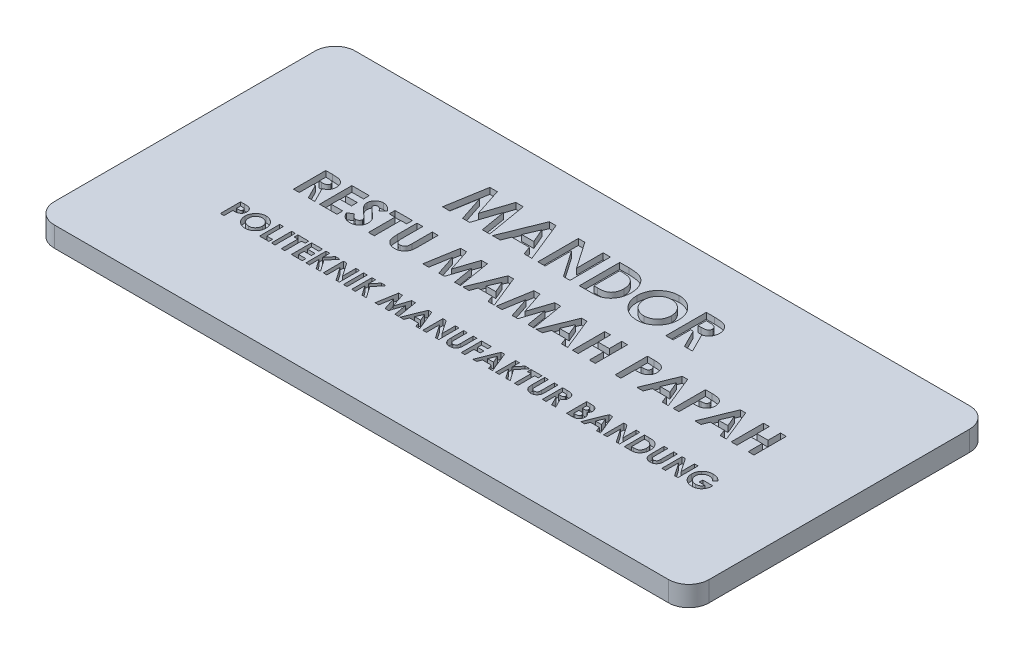
from build123d import *

# Parameters (mm, degrees)
SKETCH4_W           = 162
SKETCH4_H           = 74.5
BOSS_EXTRUDE1_DEPTH = 5
FILLET1_R           = 5
SKETCH6_W           = 0.897435898
SKETCH6_H           = 5
SKETCH6_W_2         = 0.897435897
CUT_EXTRUDE1_DEPTH  = 1.5


with BuildPart() as part:
    # Sketch4 → Boss-Extrude1 (new body)
    with BuildSketch(Plane(origin=(0, 0, 0), x_dir=(1, 0, 0), z_dir=(0, 1, 0))):
        Rectangle(SKETCH4_W, SKETCH4_H)
    extrude(amount=BOSS_EXTRUDE1_DEPTH)

    # Fillet1
    fillet1_edges = [part.edges().sort_by_distance(p)[0] for p in [
        (81, 2.5, 37.25),
        (-81, 2.5, 37.25),
        (-81, 2.5, -37.25),
        (81, 2.5, -37.25),
    ]]
    fillet(fillet1_edges, radius=FILLET1_R)

    # Sketch6 → Cut-Extrude1 (cut)
    # profile 1 of 48: a face of its own
    with BuildSketch(Plane(origin=(0, 5, 0), x_dir=(1, 0, 0), z_dir=(0, 1, 0))):
        Polygon((-30.170272436, 24.672319802), (-28.311298077, 24.672319802), (-26.025641026, 17.697159546), (-23.727964744, 24.672319802), (-21.883012821, 24.672319802), (-20.192307692, 14.672319802), (-22.009214744, 14.672319802), (-23.076923077, 20.988425572), (-25.15625, 14.672319802), (-26.905048077, 14.672319802), (-28.974358974, 20.988425572), (-30.040064103, 14.672319802), (-31.858974359, 14.672319802), align=None)
    # profile 2 of 48: a face of its own
    with BuildSketch(Plane(origin=(0, 5, 0), x_dir=(1, 0, 0), z_dir=(0, 1, 0))):
        Polygon((-15.450721154, 24.672319802), (-13.782051282, 24.672319802), (-9.743589744, 14.672319802), (-11.660657051, 14.672319802), (-12.437900641, 16.723601854), (-16.790865385, 16.723601854), (-17.570112179, 14.672319802), (-19.487179487, 14.672319802), align=None)
        Polygon((-14.615384615, 21.990028136), (-16.109775641, 18.518473649), (-13.118990385, 18.518473649), align=None, mode=Mode.SUBTRACT)
    # profile 3 of 48: a face of its own
    with BuildSketch(Plane(origin=(0, 5, 0), x_dir=(1, 0, 0), z_dir=(0, 1, 0))):
        Polygon((-8.269230769, 24.672319802), (-6.652644231, 24.672319802), (-2.115384615, 18.091790956), (-2.115384615, 24.672319802), (-0.320512821, 24.672319802), (-0.320512821, 14.672319802), (-1.94911859, 14.672319802), (-6.474358974, 21.232816597), (-6.474358974, 14.672319802), (-8.269230769, 14.672319802), align=None)
    # profile 4 of 48: a face of its own
    with BuildSketch(Plane(origin=(0, 5, 0), x_dir=(1, 0, 0), z_dir=(0, 1, 0))):
        with BuildLine():
            Line((1.987179487, 24.672319802), (4.248798077, 24.672319802))
            add(Edge.make_bspline(
                [(4.248798077, 24.672319802), (4.425117259, 24.671087271), (4.765944232, 24.668704774), (5.259735089, 24.64185976), (5.718897749, 24.600574035), (6.143728199, 24.543778038), (6.533355467, 24.46862138), (6.887277137, 24.374352084), (7.206681055, 24.265533864), (7.495069419, 24.137487147), (7.758340256, 23.988197391), (8.008324319, 23.821900589), (8.244530769, 23.632504803), (8.47027439, 23.423663854), (8.682641912, 23.191557062), (8.885170017, 22.940028956), (9.072899897, 22.665432032), (9.251506219, 22.374350258), (9.413031872, 22.065550057), (9.553920582, 21.741659871), (9.671943908, 21.404764056), (9.767843973, 21.054503568), (9.844287392, 20.692041165), (9.897773312, 20.316645432), (9.930838841, 19.928663922), (9.934193062, 19.665709803), (9.935897436, 19.532095443)],
                knots=[0, 0, 0, 0, 1.44355588, 2.790409838, 4.047694926, 5.217575253, 6.298404546, 7.294384826, 8.214239204, 9.058592145, 9.873746385, 10.689560431, 11.514393297, 12.350027578, 13.205127629, 14.088021785, 14.991911688, 15.926770944, 16.882954281, 17.842803888, 18.816321264, 19.80318086, 20.814351908, 21.847355356, 22.906180909, 24, 24, 24, 24], degree=3))
            add(Edge.make_bspline(
                [(9.935897436, 19.532095443), (9.931434465, 19.343556885), (9.922648845, 18.972407696), (9.848643692, 18.427750538), (9.728952301, 17.905642328), (9.560655335, 17.4101672), (9.352012149, 16.945737433), (9.1027645, 16.52054305), (8.816566938, 16.136866281), (8.496753683, 15.796617521), (8.150473817, 15.5041691), (7.790619209, 15.253708428), (7.413684219, 15.05619929), (7.081551815, 14.930948961), (6.793551584, 14.853054092), (6.540690498, 14.807017474), (6.253466103, 14.76479912), (5.929200284, 14.732173683), (5.569315522, 14.703079812), (5.172377314, 14.687271334), (4.739670832, 14.674136836), (4.439115267, 14.672941351), (4.282852564, 14.672319802)],
                knots=[0, 0, 0, 0, 1.315458931, 2.589557908, 3.828601765, 5.048913369, 6.235739168, 7.376350998, 8.481830359, 9.569842114, 10.627874879, 11.640079404, 12.624025415, 13.590060155, 14.111227486, 14.704434459, 15.382649715, 16.137166398, 16.978595427, 17.902333227, 18.909396075, 20, 20, 20, 20], degree=3))
            Line((4.282852564, 14.672319802), (1.987179487, 14.672319802))
            Line((1.987179487, 14.672319802), (1.987179487, 24.672319802))
        make_face()
        with BuildLine():
            Line((3.782051282, 22.877448008), (3.782051282, 16.467191597))
            Line((3.782051282, 16.467191597), (4.719551282, 16.467191597))
            add(Edge.make_bspline(
                [(4.719551282, 16.467191597), (4.831099384, 16.467396), (5.045643519, 16.467789133), (5.355396686, 16.48651443), (5.641839825, 16.505309464), (5.904184426, 16.540983067), (6.144339749, 16.58072095), (6.359006692, 16.636021656), (6.552610471, 16.694110363), (6.722786254, 16.768064486), (6.878653406, 16.851304774), (7.022968585, 16.948830422), (7.162273138, 17.057128975), (7.293962654, 17.179385649), (7.418535545, 17.313981536), (7.535254761, 17.461610147), (7.645678193, 17.621821065), (7.746971481, 17.795461364), (7.83953383, 17.980697362), (7.921647006, 18.175734781), (7.989730946, 18.38219786), (8.046318148, 18.598153858), (8.08675612, 18.825482916), (8.12021083, 19.06250124), (8.137457707, 19.310147876), (8.139824734, 19.478654923), (8.141025641, 19.564146726)],
                knots=[0, 0, 0, 0, 1.50275155, 2.890291501, 4.180787663, 5.369391935, 6.45668281, 7.458360028, 8.354766181, 9.177074746, 9.954075863, 10.732690366, 11.5210699, 12.329727389, 13.151100085, 13.990027547, 14.863562427, 15.770965086, 16.696477834, 17.652329173, 18.619756807, 19.62365428, 20.657822005, 21.729286259, 22.847956731, 24, 24, 24, 24], degree=3))
            add(Edge.make_bspline(
                [(8.141025641, 19.564146726), (8.138633841, 19.695154831), (8.133970017, 19.950610484), (8.088993105, 20.32268722), (8.015779273, 20.673053207), (7.911310188, 21.000408142), (7.779623669, 21.305672064), (7.614787293, 21.586258742), (7.423894983, 21.846881646), (7.272942553, 21.999771403), (7.197516026, 22.076165956)],
                knots=[0, 0, 0, 0, 1.13821349, 2.219428113, 3.251817212, 4.244760574, 5.201143372, 6.134805572, 7.068016741, 8, 8, 8, 8], degree=3))
            add(Edge.make_bspline(
                [(7.197516026, 22.076165956), (7.123138328, 22.141264443), (6.971230303, 22.274220731), (6.704529729, 22.433536365), (6.410639511, 22.573510766), (6.082836319, 22.684494855), (5.724288227, 22.772265804), (5.332859714, 22.832799282), (4.910646966, 22.871697452), (4.618147812, 22.875490089), (4.467147436, 22.877448008)],
                knots=[0, 0, 0, 0, 0.813307809, 1.661089106, 2.549956539, 3.493439533, 4.508053171, 5.589449661, 6.755572447, 8, 8, 8, 8], degree=3))
            Line((4.467147436, 22.877448008), (3.782051282, 22.877448008))
        make_face(mode=Mode.SUBTRACT)
    # profile 5 of 48: a face of its own
    with BuildSketch(Plane(origin=(0, 5, 0), x_dir=(1, 0, 0), z_dir=(0, 1, 0))):
        with BuildLine():
            add(Edge.make_bspline(
                [(16.430288462, 24.928730059), (16.604150717, 24.924228454), (16.947394189, 24.915341266), (17.452181472, 24.841259616), (17.938637354, 24.720554189), (18.406541861, 24.552764915), (18.854723414, 24.333347207), (19.2847629, 24.068521702), (19.695119936, 23.753289977), (20.081589515, 23.395005868), (20.438757106, 23.005387544), (20.748243033, 22.585894149), (21.012161277, 22.147395179), (21.230897424, 21.688715663), (21.397505714, 21.206679027), (21.514421642, 20.70374302), (21.589534333, 20.180050723), (21.598173448, 19.823487649), (21.602564103, 19.642271726)],
                knots=[0, 0, 0, 0, 1.014329547, 2.002516266, 2.970391464, 3.935626869, 4.897733899, 5.877609409, 6.878433252, 7.912639331, 8.949961323, 9.958554974, 10.949718813, 11.932905612, 12.9188844, 13.919928257, 14.942845884, 16, 16, 16, 16], degree=3))
            add(Edge.make_bspline(
                [(21.602564103, 19.642271726), (21.597888246, 19.463097687), (21.588674319, 19.110029496), (21.51748807, 18.591163229), (21.398603264, 18.093614715), (21.234820781, 17.61625774), (21.020051681, 17.161404458), (20.76128013, 16.726150693), (20.451677638, 16.314535706), (20.102536625, 15.926780384), (19.71816267, 15.574809226), (19.311049632, 15.264635251), (18.883077309, 15.00180553), (18.434872116, 14.786440451), (17.965472897, 14.619303544), (17.476039127, 14.501376312), (16.966601091, 14.429709552), (16.620158521, 14.42055581), (16.444310897, 14.415909546)],
                knots=[0, 0, 0, 0, 1.051557043, 2.072126891, 3.067553643, 4.050577992, 5.02905126, 6.015227836, 7.017913613, 8.04756643, 9.074058332, 10.072836633, 11.047628519, 12.017157415, 12.98668631, 13.966869689, 14.968021931, 16, 16, 16, 16], degree=3))
            add(Edge.make_bspline(
                [(16.444310897, 14.415909546), (16.260395368, 14.420077474), (15.899026492, 14.428266883), (15.370161524, 14.506144424), (14.863463187, 14.623455205), (14.383188038, 14.798535253), (13.924444887, 15.017400035), (13.490604253, 15.286945135), (13.081811935, 15.60672511), (12.700412833, 15.968550276), (12.354864323, 16.364466368), (12.049849984, 16.78271661), (11.792563622, 17.220105937), (11.582995825, 17.676839057), (11.417780992, 18.150077485), (11.301240699, 18.64270338), (11.232397567, 19.153535246), (11.222808119, 19.500502461), (11.217948718, 19.676326213)],
                knots=[0, 0, 0, 0, 1.067978421, 2.098431617, 3.099715153, 4.085208694, 5.062210972, 6.048429807, 7.046490867, 8.072918869, 9.098532598, 10.095778865, 11.076610158, 12.041847152, 13.011192615, 13.984257998, 14.978533688, 16, 16, 16, 16], degree=3))
            add(Edge.make_bspline(
                [(11.217948718, 19.676326213), (11.219473878, 19.794611228), (11.222504886, 20.0296835), (11.259016569, 20.378048608), (11.311582895, 20.719614096), (11.389325997, 21.053018139), (11.483763996, 21.380612746), (11.606121764, 21.699348587), (11.745398017, 22.012630635), (11.908129205, 22.316758639), (12.089070551, 22.608934366), (12.28649367, 22.887779573), (12.500894978, 23.149922612), (12.731583819, 23.397086181), (12.979355177, 23.627645655), (13.240949876, 23.844864924), (13.52144133, 24.042973873), (13.814690462, 24.226810717), (14.119043999, 24.393051187), (14.433262947, 24.534550103), (14.750873775, 24.658118696), (15.076119335, 24.755644494), (15.405514043, 24.835078236), (15.742576814, 24.887609132), (16.084262477, 24.924119804), (16.314672737, 24.92718966), (16.430288462, 24.928730059)],
                knots=[0, 0, 0, 0, 1.034744296, 2.056386356, 3.06226378, 4.057406941, 5.050368692, 6.043467995, 7.042652155, 8.049140477, 9.059438543, 10.048523776, 11.036952808, 12.020949711, 13.004946614, 13.997082645, 14.994316842, 16.007702937, 17.024872941, 18.026463647, 19.021641123, 20.005082605, 20.995858141, 21.984425357, 22.988620895, 24, 24, 24, 24], degree=3))
        make_face()
        with BuildLine():
            add(Edge.make_bspline(
                [(16.40224359, 23.133858264), (16.285234315, 23.130718642), (16.054304829, 23.124522286), (15.715573329, 23.077314429), (15.390379126, 23.001918116), (15.080524902, 22.892707478), (14.784667719, 22.753710054), (14.502283117, 22.585411517), (14.237281536, 22.382026794), (13.986129439, 22.154474704), (13.759254846, 21.90092938), (13.558803986, 21.629212446), (13.391058902, 21.339777663), (13.250571344, 21.035313814), (13.144815349, 20.712397283), (13.069488525, 20.373557509), (13.021884784, 20.018210655), (13.015884273, 19.775971167), (13.012820513, 19.652287751)],
                knots=[0, 0, 0, 0, 1.033739768, 2.040188636, 3.016340934, 3.979330865, 4.937572243, 5.900995986, 6.878200029, 7.884839167, 8.891893314, 9.879764717, 10.863503415, 11.843163062, 12.837761627, 13.859916423, 14.907309254, 16, 16, 16, 16], degree=3))
            add(Edge.make_bspline(
                [(13.012820513, 19.652287751), (13.016882591, 19.515218704), (13.024843591, 19.246586084), (13.080858155, 18.854712055), (13.176693498, 18.484625928), (13.31507787, 18.138137739), (13.486710796, 17.811399996), (13.699851651, 17.508417335), (13.951048562, 17.227375637), (14.144568627, 17.063291787), (14.242788462, 16.98001211)],
                knots=[0, 0, 0, 0, 1.078454662, 2.113592447, 3.107694534, 4.079536787, 5.043276885, 6.005368276, 6.987637804, 8, 8, 8, 8], degree=3))
            add(Edge.make_bspline(
                [(14.242788462, 16.98001211), (14.323249257, 16.918488283), (14.482358053, 16.796826771), (14.736330333, 16.640892586), (14.997871771, 16.507241434), (15.268956027, 16.399252884), (15.549010583, 16.314310905), (15.837997036, 16.254827435), (16.135505917, 16.217496413), (16.336695365, 16.213034648), (16.438301282, 16.210781341)],
                knots=[0, 0, 0, 0, 1.023928204, 2.024787132, 3.009472467, 3.9914905, 4.972207045, 5.96565515, 6.972602802, 8, 8, 8, 8], degree=3))
            add(Edge.make_bspline(
                [(16.438301282, 16.210781341), (16.55329858, 16.213947583), (16.77955938, 16.220177264), (17.11198521, 16.266803966), (17.430459252, 16.34571318), (17.736958619, 16.453965784), (18.030599505, 16.594708441), (18.309946806, 16.76822707), (18.575490294, 16.972391087), (18.826322428, 17.202931435), (19.055594855, 17.457475552), (19.255627415, 17.730641796), (19.428705954, 18.016411498), (19.566272072, 18.318829294), (19.676206247, 18.635040501), (19.750626474, 18.966445552), (19.798632359, 19.311678268), (19.80463456, 19.546621332), (19.807692308, 19.666310187)],
                knots=[0, 0, 0, 0, 1.026359118, 2.019393844, 2.989460624, 3.950973911, 4.916101784, 5.890408035, 6.881132271, 7.902007068, 8.92769091, 9.933912415, 10.920395702, 11.90457117, 12.894218921, 13.903490204, 14.931958862, 16, 16, 16, 16], degree=3))
            add(Edge.make_bspline(
                [(19.807692308, 19.666310187), (19.804528762, 19.785310798), (19.798301803, 20.019545353), (19.751593036, 20.363890478), (19.673184243, 20.693832472), (19.564606568, 21.009910166), (19.425958627, 21.312433433), (19.254506383, 21.600338422), (19.05085144, 21.873346799), (18.819680903, 22.129598117), (18.568065983, 22.365076664), (18.297932224, 22.569429237), (18.016838274, 22.747005125), (17.718334465, 22.886110906), (17.408527935, 22.996936186), (17.085528229, 23.078549513), (16.748111965, 23.124190648), (16.518560704, 23.130607001), (16.40224359, 23.133858264)],
                knots=[0, 0, 0, 0, 1.055025985, 2.07665775, 3.074803781, 4.057872707, 5.035505728, 6.020516407, 7.023567878, 8.050795229, 9.077271434, 10.074415901, 11.050397877, 12.019801805, 12.988065821, 13.964604439, 14.968634123, 16, 16, 16, 16], degree=3))
        make_face(mode=Mode.SUBTRACT)
    # profile 6 of 48: a face of its own
    with BuildSketch(Plane(origin=(0, 5, 0), x_dir=(1, 0, 0), z_dir=(0, 1, 0))):
        with BuildLine():
            Line((23.397435897, 24.672319802), (25.488782051, 24.672319802))
            add(Edge.make_bspline(
                [(25.488782051, 24.672319802), (25.627019395, 24.671829139), (25.892888748, 24.670885456), (26.276257832, 24.655996628), (26.628435058, 24.635277602), (26.949941856, 24.603659819), (27.240640679, 24.56173846), (27.500822876, 24.512320115), (27.730480843, 24.455997316), (27.931551426, 24.385814664), (28.113007685, 24.306649697), (28.282150145, 24.215687699), (28.442710341, 24.113941559), (28.593615102, 23.998734063), (28.736175825, 23.872137763), (28.870661459, 23.734025228), (28.995171598, 23.583225322), (29.108935271, 23.420690908), (29.212621701, 23.249708431), (29.304258758, 23.070043133), (29.378778165, 22.881570066), (29.44462405, 22.687013075), (29.492050707, 22.483590929), (29.525035254, 22.273283977), (29.549185248, 22.055351917), (29.550573758, 21.907298551), (29.551282051, 21.831774931)],
                knots=[0, 0, 0, 0, 1.749336639, 3.364467119, 4.854658419, 6.213483162, 7.451590619, 8.570285859, 9.5643256, 10.440900261, 11.26203566, 12.067320669, 12.869050712, 13.665104639, 14.467235401, 15.27997916, 16.102287765, 16.939272006, 17.78853747, 18.631303466, 19.488103222, 20.351255419, 21.228522269, 22.127379805, 23.044756219, 24, 24, 24, 24], degree=3))
            add(Edge.make_bspline(
                [(29.551282051, 21.831774931), (29.549442159, 21.75294562), (29.545834467, 21.59837571), (29.526401471, 21.371325119), (29.490884059, 21.154098995), (29.437087772, 20.947333349), (29.375255927, 20.748454742), (29.293035434, 20.561132609), (29.200241481, 20.38264262), (29.090032815, 20.215509584), (28.969084188, 20.056021143), (28.828423479, 19.91028789), (28.677163341, 19.770477215), (28.506800891, 19.645346383), (28.324845865, 19.526434501), (28.127683006, 19.418668669), (27.916599069, 19.319339901), (27.768196607, 19.263947319), (27.692307692, 19.235621084)],
                knots=[0, 0, 0, 0, 1.099860209, 2.156625411, 3.176576793, 4.16617041, 5.135385252, 6.078461593, 7.016046972, 7.938469504, 8.868247731, 9.803980173, 10.76021508, 11.73834243, 12.748633912, 13.790971185, 14.870363756, 16, 16, 16, 16], degree=3))
            Line((27.692307692, 19.235621084), (30, 14.672319802))
            Line((30, 14.672319802), (28.004807692, 14.672319802))
            Line((28.004807692, 14.672319802), (25.801282051, 19.031294161))
            Line((25.801282051, 19.031294161), (25.192307692, 19.031294161))
            Line((25.192307692, 19.031294161), (25.192307692, 14.672319802))
            Line((25.192307692, 14.672319802), (23.397435897, 14.672319802))
            Line((23.397435897, 14.672319802), (23.397435897, 24.672319802))
        make_face()
        with BuildLine():
            Line((25.192307692, 20.826165956), (25.891426282, 20.826165956))
            add(Edge.make_bspline(
                [(25.891426282, 20.826165956), (25.976899341, 20.827128611), (26.140561883, 20.828971889), (26.375930115, 20.837521774), (26.589700601, 20.858122773), (26.782791345, 20.884151365), (26.956173962, 20.914205134), (27.108301939, 20.957274008), (27.241519338, 21.003423398), (27.354247526, 21.060775118), (27.4505599, 21.125996463), (27.533719471, 21.200089532), (27.602504359, 21.285842825), (27.659117831, 21.380925937), (27.703156957, 21.486179856), (27.735302145, 21.600449131), (27.753266551, 21.725035436), (27.755333417, 21.811016951), (27.756410256, 21.855813392)],
                knots=[0, 0, 0, 0, 1.688639943, 3.233382647, 4.650958383, 5.928841754, 7.082724185, 8.122798841, 9.049171256, 9.863274652, 10.613301712, 11.341792392, 12.054588806, 12.776240173, 13.521029143, 14.301969904, 15.115324896, 16, 16, 16, 16], degree=3))
            add(Edge.make_bspline(
                [(27.756410256, 21.855813392), (27.754374394, 21.908810853), (27.750375318, 22.012914543), (27.710692069, 22.162787353), (27.647524907, 22.301504893), (27.560940029, 22.428440402), (27.451897632, 22.539720832), (27.326762878, 22.637815418), (27.182835057, 22.715381276), (27.049568726, 22.76654289), (26.928327515, 22.797153412), (26.818911147, 22.819964102), (26.692206334, 22.836130693), (26.548117421, 22.85327824), (26.387011695, 22.864397556), (26.208011034, 22.872512441), (26.011629526, 22.875832639), (25.874732964, 22.876894048), (25.803285256, 22.877448008)],
                knots=[0, 0, 0, 0, 1.020303359, 2.004196876, 2.966617323, 3.9489082, 4.950758222, 5.960522915, 7.003732012, 8.091992268, 8.70421221, 9.413913587, 10.24622431, 11.166358409, 12.212345909, 13.359657661, 14.621978493, 16, 16, 16, 16], degree=3))
            Line((25.803285256, 22.877448008), (25.192307692, 22.877448008))
            Line((25.192307692, 22.877448008), (25.192307692, 20.826165956))
        make_face(mode=Mode.SUBTRACT)
    # profile 7 of 48: a face of its own
    with BuildSketch(Plane(origin=(0, 5, 0), x_dir=(1, 0, 0), z_dir=(0, 1, 0))):
        with BuildLine():
            Line((-54.076923077, 8), (-52.403846154, 8))
            add(Edge.make_bspline(
                [(-52.403846154, 8), (-52.293256279, 7.999607469), (-52.080560797, 7.998852523), (-51.773865529, 7.98694146), (-51.492123749, 7.97036624), (-51.23491831, 7.945072013), (-51.002359252, 7.911534926), (-50.794213494, 7.87200025), (-50.610487121, 7.826942011), (-50.449630654, 7.770795889), (-50.304465647, 7.707463916), (-50.169151679, 7.634694317), (-50.040703522, 7.553297406), (-49.919979713, 7.461131408), (-49.805931135, 7.359854368), (-49.698342628, 7.249364341), (-49.598734516, 7.128724416), (-49.507723578, 6.998696884), (-49.424774434, 6.861910903), (-49.351464789, 6.718178664), (-49.291849263, 6.567400211), (-49.239172555, 6.411754618), (-49.201231229, 6.249016901), (-49.174843592, 6.08077134), (-49.155523596, 5.906425691), (-49.154412789, 5.787982999), (-49.153846154, 5.727564103)],
                knots=[0, 0, 0, 0, 1.749336639, 3.364467119, 4.854658419, 6.213483162, 7.451590619, 8.570285859, 9.5643256, 10.440900261, 11.26203566, 12.067320669, 12.869050712, 13.665104639, 14.467235401, 15.27997916, 16.102287765, 16.939272006, 17.78853747, 18.631303466, 19.488103222, 20.351255419, 21.228522269, 22.127379805, 23.044756219, 24, 24, 24, 24], degree=3))
            add(Edge.make_bspline(
                [(-49.153846154, 5.727564103), (-49.155318067, 5.664500654), (-49.158204222, 5.540844726), (-49.173750618, 5.359204253), (-49.202164548, 5.185423354), (-49.245201578, 5.020010837), (-49.294667053, 4.860907952), (-49.360443448, 4.711050245), (-49.43467861, 4.568258254), (-49.522845543, 4.434551826), (-49.619604444, 4.306961072), (-49.732133012, 4.19037447), (-49.853141122, 4.07852593), (-49.989431082, 3.978421265), (-50.134995103, 3.883291759), (-50.29272539, 3.797079093), (-50.46159254, 3.717616079), (-50.580314509, 3.673302013), (-50.641025641, 3.650641026)],
                knots=[0, 0, 0, 0, 1.099860209, 2.156625411, 3.176576793, 4.16617041, 5.135385252, 6.078461593, 7.016046972, 7.938469504, 8.868247731, 9.803980173, 10.76021508, 11.73834243, 12.748633912, 13.790971185, 14.870363756, 16, 16, 16, 16], degree=3))
            Line((-50.641025641, 3.650641026), (-48.794871795, 0))
            Line((-48.794871795, 0), (-50.391025641, 0))
            Line((-50.391025641, 0), (-52.153846154, 3.487179487))
            Line((-52.153846154, 3.487179487), (-52.641025641, 3.487179487))
            Line((-52.641025641, 3.487179487), (-52.641025641, 0))
            Line((-52.641025641, 0), (-54.076923077, 0))
            Line((-54.076923077, 0), (-54.076923077, 8))
        make_face()
        with BuildLine():
            Line((-52.641025641, 4.923076923), (-52.081730769, 4.923076923))
            add(Edge.make_bspline(
                [(-52.081730769, 4.923076923), (-52.013352322, 4.923847047), (-51.882422288, 4.925321669), (-51.694127703, 4.932161577), (-51.523111314, 4.948642376), (-51.368638719, 4.96946525), (-51.229932626, 4.993508265), (-51.108230243, 5.027963365), (-51.001656325, 5.064882876), (-50.911473774, 5.110764253), (-50.834423875, 5.162941328), (-50.767896218, 5.222215784), (-50.712868308, 5.290818418), (-50.66757753, 5.366884908), (-50.63234623, 5.451088043), (-50.606630079, 5.542503463), (-50.592258554, 5.642172507), (-50.590605061, 5.710957719), (-50.58974359, 5.746794872)],
                knots=[0, 0, 0, 0, 1.688639943, 3.233382647, 4.650958383, 5.928841754, 7.082724185, 8.122798841, 9.049171256, 9.863274652, 10.613301712, 11.341792392, 12.054588806, 12.776240173, 13.521029143, 14.301969904, 15.115324896, 16, 16, 16, 16], degree=3))
            add(Edge.make_bspline(
                [(-50.58974359, 5.746794872), (-50.59137228, 5.78919284), (-50.59457154, 5.872475792), (-50.62631814, 5.99237404), (-50.67685187, 6.103348072), (-50.746119772, 6.20489648), (-50.83335369, 6.293920824), (-50.933461493, 6.372396492), (-51.048603749, 6.434449179), (-51.155216814, 6.47537847), (-51.252209783, 6.499866888), (-51.339742877, 6.51811544), (-51.441106728, 6.531048712), (-51.556377858, 6.54476675), (-51.685262439, 6.553662203), (-51.828462968, 6.560154111), (-51.985568174, 6.562810269), (-52.095085424, 6.563659396), (-52.15224359, 6.564102564)],
                knots=[0, 0, 0, 0, 1.020303359, 2.004196876, 2.966617323, 3.9489082, 4.950758222, 5.960522915, 7.003732012, 8.091992268, 8.70421221, 9.413913587, 10.24622431, 11.166358409, 12.212345909, 13.359657661, 14.621978493, 16, 16, 16, 16], degree=3))
            Line((-52.15224359, 6.564102564), (-52.641025641, 6.564102564))
            Line((-52.641025641, 6.564102564), (-52.641025641, 4.923076923))
        make_face(mode=Mode.SUBTRACT)
    # profile 8 of 48: a face of its own
    with BuildSketch(Plane(origin=(0, 5, 0), x_dir=(1, 0, 0), z_dir=(0, 1, 0))):
        Polygon((-47.615384615, 8), (-43.307692308, 8), (-43.307692308, 6.564102564), (-46.179487179, 6.564102564), (-46.179487179, 5.025641026), (-43.307692308, 5.025641026), (-43.307692308, 3.58974359), (-46.179487179, 3.58974359), (-46.179487179, 1.435897436), (-43.307692308, 1.435897436), (-43.307692308, 0), (-47.615384615, 0), align=None)
    # profile 9 of 48: a face of its own
    with BuildSketch(Plane(origin=(0, 5, 0), x_dir=(1, 0, 0), z_dir=(0, 1, 0))):
        with BuildLine():
            Line((-37.769230769, 6.931089744), (-38.842948718, 5.948717949))
            add(Edge.make_bspline(
                [(-38.842948718, 5.948717949), (-38.888942191, 6.013596524), (-38.977243245, 6.13815434), (-39.120370043, 6.304940193), (-39.262850551, 6.447220936), (-39.406004763, 6.564402189), (-39.551101544, 6.655771987), (-39.697889027, 6.720462813), (-39.845535032, 6.761587385), (-39.944730357, 6.766708384), (-39.993589744, 6.769230769)],
                knots=[0, 0, 0, 0, 1.299362458, 2.494594718, 3.587462134, 4.587049575, 5.512617175, 6.380583204, 7.202344345, 8, 8, 8, 8], degree=3))
            add(Edge.make_bspline(
                [(-39.993589744, 6.769230769), (-40.039164378, 6.76763247), (-40.127157023, 6.764546574), (-40.252597067, 6.733873), (-40.363964525, 6.680934914), (-40.461150706, 6.611713914), (-40.5381365, 6.528318657), (-40.599603687, 6.440858475), (-40.634214878, 6.344322214), (-40.638770391, 6.278017215), (-40.641025641, 6.245192308)],
                knots=[0, 0, 0, 0, 1.185010067, 2.2879431, 3.333075148, 4.379039566, 5.372662701, 6.27520591, 7.14612461, 8, 8, 8, 8], degree=3))
            add(Edge.make_bspline(
                [(-40.641025641, 6.245192308), (-40.63961239, 6.21189405), (-40.6367663, 6.144835988), (-40.609276943, 6.046554046), (-40.567842632, 5.950521147), (-40.528250456, 5.892061352), (-40.508012821, 5.862179487)],
                knots=[0, 0, 0, 0, 0.967525499, 1.948461899, 2.951351359, 4, 4, 4, 4], degree=3))
            add(Edge.make_bspline(
                [(-40.508012821, 5.862179487), (-40.48961462, 5.838952626), (-40.447264393, 5.78548746), (-40.366511184, 5.70080697), (-40.265102112, 5.597065958), (-40.139134744, 5.477831774), (-39.993838331, 5.338816288), (-39.822478197, 5.185484254), (-39.629986834, 5.013087156), (-39.493168432, 4.89303606), (-39.421474359, 4.830128205)],
                knots=[0, 0, 0, 0, 0.473873513, 1.090794244, 1.870441696, 2.795289791, 3.865433203, 5.087734844, 6.473946851, 8, 8, 8, 8], degree=3))
            add(Edge.make_bspline(
                [(-39.421474359, 4.830128205), (-39.354179158, 4.771887603), (-39.226466847, 4.66135904), (-39.044757591, 4.504481491), (-38.885065418, 4.363342586), (-38.745063977, 4.240060517), (-38.626875555, 4.133341773), (-38.530003287, 4.04267624), (-38.453264041, 3.969829009), (-38.409642273, 3.925829237), (-38.391025641, 3.907051282)],
                knots=[0, 0, 0, 0, 1.543621617, 2.929473131, 4.163658386, 5.240097082, 6.164993805, 6.925417477, 7.541396219, 8, 8, 8, 8], degree=3))
            add(Edge.make_bspline(
                [(-38.391025641, 3.907051282), (-38.320398019, 3.830617069), (-38.184626927, 3.68368367), (-38.00817237, 3.45598311), (-37.862944561, 3.233700934), (-37.750593575, 3.012654544), (-37.665741591, 2.789654678), (-37.605919818, 2.559232278), (-37.570092161, 2.318979574), (-37.566114454, 2.155036433), (-37.564102564, 2.072115385)],
                knots=[0, 0, 0, 0, 1.206664779, 2.319633467, 3.337109185, 4.282041471, 5.190008762, 6.099243693, 7.03861361, 8, 8, 8, 8], degree=3))
            add(Edge.make_bspline(
                [(-37.564102564, 2.072115385), (-37.565534576, 1.991318993), (-37.568344237, 1.832793465), (-37.602757191, 1.600814968), (-37.651828045, 1.378801479), (-37.727700193, 1.169168817), (-37.820172718, 0.968475928), (-37.936100383, 0.779848967), (-38.07224153, 0.601378953), (-38.228280188, 0.436256255), (-38.400877472, 0.286418853), (-38.586004463, 0.153030058), (-38.785471425, 0.042900617), (-38.997574145, -0.047783123), (-39.222199087, -0.117628951), (-39.459078657, -0.169251528), (-39.708575178, -0.200234585), (-39.879184494, -0.203473496), (-39.966346154, -0.205128205)],
                knots=[0, 0, 0, 0, 1.043214005, 2.046824704, 3.02475056, 3.976699089, 4.921714032, 5.875962561, 6.831408892, 7.817874052, 8.806269674, 9.781291748, 10.760897367, 11.74438705, 12.757449933, 13.795994037, 14.874007457, 16, 16, 16, 16], degree=3))
            add(Edge.make_bspline(
                [(-39.966346154, -0.205128205), (-40.034767314, -0.203914368), (-40.170280452, -0.201510275), (-40.37000633, -0.181882854), (-40.562864242, -0.150206284), (-40.748636953, -0.104804298), (-40.9281614, -0.047273824), (-41.101444956, 0.022997447), (-41.267291388, 0.107098693), (-41.426955569, 0.203300457), (-41.579661332, 0.315003377), (-41.727339584, 0.439923723), (-41.868523442, 0.579982827), (-42.003890985, 0.734849454), (-42.132576093, 0.904962148), (-42.258791091, 1.087951777), (-42.376926606, 1.287214378), (-42.449904168, 1.426998705), (-42.487179487, 1.498397436)],
                knots=[0, 0, 0, 0, 1.016823716, 2.013894106, 2.979844003, 3.91962641, 4.853723003, 5.779685073, 6.695824784, 7.614987388, 8.547259901, 9.504950863, 10.487499108, 11.500346958, 12.559593716, 13.656357062, 14.802919212, 16, 16, 16, 16], degree=3))
            Line((-42.487179487, 1.498397436), (-41.224358974, 2.256410256))
            add(Edge.make_bspline(
                [(-41.224358974, 2.256410256), (-41.177733121, 2.175363368), (-41.088347377, 2.019989555), (-40.936874875, 1.811225146), (-40.781699031, 1.632452987), (-40.619232317, 1.486832886), (-40.451450267, 1.372417716), (-40.277542455, 1.290648698), (-40.097386698, 1.240033769), (-39.97467278, 1.233852517), (-39.913461538, 1.230769231)],
                knots=[0, 0, 0, 0, 1.283663364, 2.460892379, 3.537111102, 4.529833553, 5.449777664, 6.316464042, 7.160231139, 8, 8, 8, 8], degree=3))
            add(Edge.make_bspline(
                [(-39.913461538, 1.230769231), (-39.851200942, 1.233287209), (-39.730406317, 1.238172454), (-39.557987448, 1.283295991), (-39.3999073, 1.354143253), (-39.263263987, 1.455232527), (-39.147563046, 1.571904913), (-39.06216911, 1.701708277), (-39.008524063, 1.842152384), (-39.002852481, 1.939714099), (-39, 1.988782051)],
                knots=[0, 0, 0, 0, 1.13588714, 2.203786484, 3.234766741, 4.283437687, 5.291419208, 6.222934724, 7.106237994, 8, 8, 8, 8], degree=3))
            add(Edge.make_bspline(
                [(-39, 1.988782051), (-39.002634149, 2.034431796), (-39.007985171, 2.127164882), (-39.04739915, 2.265044069), (-39.109015221, 2.402860552), (-39.181911379, 2.51590136), (-39.256092346, 2.610547364), (-39.327026083, 2.692553845), (-39.41340461, 2.78315665), (-39.515008909, 2.88246975), (-39.630496524, 2.991367424), (-39.759964736, 3.109839008), (-39.904896094, 3.236840909), (-40.007333863, 3.323353349), (-40.060897436, 3.368589744)],
                knots=[0, 0, 0, 0, 0.916159276, 1.861089862, 2.860218735, 3.940849679, 4.552606315, 5.27541173, 6.11797699, 7.06649574, 8.129236253, 9.306560635, 10.591630461, 12, 12, 12, 12], degree=3))
            add(Edge.make_bspline(
                [(-40.060897436, 3.368589744), (-40.162723919, 3.454744713), (-40.358159761, 3.620102176), (-40.634335401, 3.864329943), (-40.883194381, 4.09258317), (-41.102587287, 4.307683565), (-41.295309526, 4.505658723), (-41.460055897, 4.688116674), (-41.595016587, 4.856464831), (-41.737033613, 5.055861957), (-41.871978182, 5.298841056), (-41.988608583, 5.59117308), (-42.064273465, 5.883468011), (-42.072750662, 6.079698729), (-42.076923077, 6.176282051)],
                knots=[0, 0, 0, 0, 1.345494975, 2.582412109, 3.71882943, 4.751509156, 5.681369928, 6.505683931, 7.230279997, 7.856715994, 8.973648664, 10.023341002, 11.027102913, 12, 12, 12, 12], degree=3))
            add(Edge.make_bspline(
                [(-42.076923077, 6.176282051), (-42.075187775, 6.24477376), (-42.071769045, 6.379709782), (-42.041273439, 6.578113543), (-41.995696595, 6.769556501), (-41.929505933, 6.953340186), (-41.843598446, 7.129234402), (-41.739267139, 7.298100223), (-41.614891946, 7.458383449), (-41.4747295, 7.609977821), (-41.320306371, 7.748517826), (-41.155285632, 7.870793262), (-40.980601317, 7.974068874), (-40.797322055, 8.059743493), (-40.604312141, 8.125321971), (-40.40299347, 8.171807265), (-40.193077288, 8.199455235), (-40.050296832, 8.203213656), (-39.977564103, 8.205128205)],
                knots=[0, 0, 0, 0, 1.010766082, 1.991317756, 2.957454644, 3.913069143, 4.869106762, 5.843196583, 6.838735724, 7.860187025, 8.887984031, 9.89767229, 10.887916223, 11.879572884, 12.879850636, 13.892031539, 14.926195476, 16, 16, 16, 16], degree=3))
            add(Edge.make_bspline(
                [(-39.977564103, 8.205128205), (-39.883306085, 8.201680046), (-39.69553409, 8.194810946), (-39.41790778, 8.141096832), (-39.146734007, 8.056625729), (-38.928217099, 7.954720636), (-38.754347275, 7.856005125), (-38.621092295, 7.765120318), (-38.485498182, 7.661006885), (-38.346471451, 7.54333674), (-38.206595434, 7.409892822), (-38.061892789, 7.263851868), (-37.914335264, 7.103951742), (-37.818446269, 6.989719834), (-37.769230769, 6.931089744)],
                knots=[0, 0, 0, 0, 1.282922637, 2.555718331, 3.837320111, 5.142675274, 5.830281639, 6.55870424, 7.337177975, 8.157850921, 9.037902056, 9.96903443, 10.957596896, 12, 12, 12, 12], degree=3))
        make_face()
    # profile 10 of 48: a face of its own
    with BuildSketch(Plane(origin=(0, 5, 0), x_dir=(1, 0, 0), z_dir=(0, 1, 0))):
        Polygon((-36.948717949, 8), (-32.641025641, 8), (-32.641025641, 6.564102564), (-34.076923077, 6.564102564), (-34.076923077, 0), (-35.512820513, 0), (-35.512820513, 6.564102564), (-36.948717949, 6.564102564), align=None)
    # profile 11 of 48: a face of its own
    with BuildSketch(Plane(origin=(0, 5, 0), x_dir=(1, 0, 0), z_dir=(0, 1, 0))):
        with BuildLine():
            Line((-31.512820513, 8), (-30.076923077, 8))
            Line((-30.076923077, 8), (-30.076923077, 2.794871795))
            add(Edge.make_bspline(
                [(-30.076923077, 2.794871795), (-30.076845, 2.740907283), (-30.076694195, 2.636675387), (-30.06914482, 2.487136741), (-30.062236622, 2.349679415), (-30.049772271, 2.224453897), (-30.031358152, 2.111406617), (-30.013527276, 2.009811402), (-29.98939495, 1.921487198), (-29.953127921, 1.820951131), (-29.897252335, 1.707993367), (-29.805954727, 1.590266195), (-29.700605098, 1.482823063), (-29.574337501, 1.393391471), (-29.432423887, 1.321049373), (-29.275644011, 1.267451885), (-29.104218875, 1.237658798), (-28.985687797, 1.233110337), (-28.924679487, 1.230769231)],
                knots=[0, 0, 0, 0, 1.155499968, 2.231836252, 3.205919964, 4.102923608, 4.924856345, 5.658536265, 6.31071849, 6.882491295, 7.94666036, 8.992281882, 10.060072772, 11.158554251, 12.289267114, 13.461410017, 14.693379945, 16, 16, 16, 16], degree=3))
            add(Edge.make_bspline(
                [(-28.924679487, 1.230769231), (-28.859865687, 1.232660544), (-28.73348975, 1.236348286), (-28.551718083, 1.272547458), (-28.383305603, 1.330188938), (-28.231818176, 1.41245802), (-28.097406556, 1.511071933), (-27.983629937, 1.623522697), (-27.893837847, 1.750034594), (-27.835314703, 1.866751453), (-27.80245684, 1.974179157), (-27.777828235, 2.070161735), (-27.759772743, 2.183411676), (-27.743392207, 2.312160338), (-27.733548766, 2.457741309), (-27.72287516, 2.618983808), (-27.718963185, 2.7969911), (-27.718296417, 2.920940918), (-27.717948718, 2.985576923)],
                knots=[0, 0, 0, 0, 1.261321664, 2.459363699, 3.594844139, 4.716940403, 5.803436589, 6.833651888, 7.818396249, 8.814403945, 9.360733334, 10.004355033, 10.743453831, 11.592799886, 12.532235708, 13.585170094, 14.740740724, 16, 16, 16, 16], degree=3))
            Line((-27.717948718, 2.985576923), (-27.717948718, 8))
            Line((-27.717948718, 8), (-26.282051282, 8))
            Line((-26.282051282, 8), (-26.282051282, 3.227564103))
            add(Edge.make_bspline(
                [(-26.282051282, 3.227564103), (-26.282250683, 3.130874779), (-26.28263411, 2.944950641), (-26.288522403, 2.677764569), (-26.301057512, 2.433732952), (-26.311585558, 2.212784483), (-26.331960933, 2.015216816), (-26.353187294, 1.840186281), (-26.380242117, 1.688313147), (-26.420498066, 1.515424041), (-26.489967918, 1.316348566), (-26.601962425, 1.087121787), (-26.744132205, 0.862694886), (-26.912169779, 0.645536712), (-27.10189957, 0.443803767), (-27.309114864, 0.266708354), (-27.530523525, 0.116904731), (-27.768439114, -0.001944223), (-28.022659152, -0.094637447), (-28.295698958, -0.156922625), (-28.58737234, -0.199003273), (-28.788836658, -0.203045637), (-28.892628205, -0.205128205)],
                knots=[0, 0, 0, 0, 1.170808336, 2.251350247, 3.235597562, 4.129743112, 4.929140599, 5.639994148, 6.264258765, 6.79612947, 7.788252245, 8.809469599, 9.879094798, 10.999557536, 12.129761673, 13.226370002, 14.293821979, 15.358369427, 16.438775801, 17.562147481, 18.744053101, 20, 20, 20, 20], degree=3))
            add(Edge.make_bspline(
                [(-28.892628205, -0.205128205), (-28.961589374, -0.203966645), (-29.097648346, -0.201674912), (-29.297746932, -0.181467807), (-29.491181523, -0.151690133), (-29.677588656, -0.108247572), (-29.857615315, -0.052127898), (-30.031213672, 0.016951512), (-30.197738593, 0.098605343), (-30.356258229, 0.192082555), (-30.506577506, 0.293162068), (-30.643961566, 0.405212964), (-30.773138117, 0.519948654), (-30.890375302, 0.642197706), (-30.996553676, 0.77067671), (-31.091454567, 0.905676844), (-31.174936981, 1.047186116), (-31.249100874, 1.197755222), (-31.312577928, 1.365037047), (-31.366091469, 1.554981873), (-31.412842157, 1.770566896), (-31.447584511, 2.012277819), (-31.479082132, 2.279317988), (-31.49901839, 2.572383083), (-31.509447944, 2.891481515), (-31.511667917, 3.112705842), (-31.512820513, 3.227564103)],
                knots=[0, 0, 0, 0, 1.001158378, 1.975264943, 2.917723546, 3.841610987, 4.75185031, 5.653588123, 6.552117133, 7.442167995, 8.324307438, 9.179605724, 10.014504199, 10.831958861, 11.636465792, 12.43274043, 13.225645099, 14.020104002, 14.867201867, 15.819789774, 16.883317127, 18.068162734, 19.364263498, 20.787406516, 22.332041935, 24, 24, 24, 24], degree=3))
            Line((-31.512820513, 3.227564103), (-31.512820513, 8))
        make_face()
    # profile 12 of 48: a face of its own
    with BuildSketch(Plane(origin=(0, 5, 0), x_dir=(1, 0, 0), z_dir=(0, 1, 0))):
        Polygon((-20.725961538, 8), (-19.238782051, 8), (-17.41025641, 2.419871795), (-15.572115385, 8), (-14.096153846, 8), (-12.743589744, 0), (-14.197115385, 0), (-15.051282051, 5.052884615), (-16.71474359, 0), (-18.113782051, 0), (-19.769230769, 5.052884615), (-20.621794872, 0), (-22.076923077, 0), align=None)
    # profile 13 of 48: a face of its own
    with BuildSketch(Plane(origin=(0, 5, 0), x_dir=(1, 0, 0), z_dir=(0, 1, 0))):
        Polygon((-8.950320513, 8), (-7.615384615, 8), (-4.384615385, 0), (-5.918269231, 0), (-6.540064103, 1.641025641), (-10.022435897, 1.641025641), (-10.645833333, 0), (-12.179487179, 0), align=None)
        Polygon((-8.282051282, 5.854166667), (-9.477564103, 3.076923077), (-7.084935897, 3.076923077), align=None, mode=Mode.SUBTRACT)
    # profile 14 of 48: a face of its own
    with BuildSketch(Plane(origin=(0, 5, 0), x_dir=(1, 0, 0), z_dir=(0, 1, 0))):
        Polygon((-2.572115385, 8), (-1.084935897, 8), (0.743589744, 2.419871795), (2.581730769, 8), (4.057692308, 8), (5.41025641, 0), (3.956730769, 0), (3.102564103, 5.052884615), (1.439102564, 0), (0.040064103, 0), (-1.615384615, 5.052884615), (-2.467948718, 0), (-3.923076923, 0), align=None)
    # profile 15 of 48: a face of its own
    with BuildSketch(Plane(origin=(0, 5, 0), x_dir=(1, 0, 0), z_dir=(0, 1, 0))):
        Polygon((9.203525641, 8), (10.538461538, 8), (13.769230769, 0), (12.235576923, 0), (11.613782051, 1.641025641), (8.131410256, 1.641025641), (7.508012821, 0), (5.974358974, 0), align=None)
        Polygon((9.871794872, 5.854166667), (8.676282051, 3.076923077), (11.068910256, 3.076923077), align=None, mode=Mode.SUBTRACT)
    # profile 16 of 48: a face of its own
    with BuildSketch(Plane(origin=(0, 5, 0), x_dir=(1, 0, 0), z_dir=(0, 1, 0))):
        Polygon((14.948717949, 8), (16.384615385, 8), (16.384615385, 4.923076923), (19.153846154, 4.923076923), (19.153846154, 8), (20.58974359, 8), (20.58974359, 0), (19.153846154, 0), (19.153846154, 3.487179487), (16.384615385, 3.487179487), (16.384615385, 0), (14.948717949, 0), align=None)
    # profile 17 of 48: a face of its own
    with BuildSketch(Plane(origin=(0, 5, 0), x_dir=(1, 0, 0), z_dir=(0, 1, 0))):
        with BuildLine():
            Line((25.512820513, 8), (27.115384615, 8))
            add(Edge.make_bspline(
                [(27.115384615, 8), (27.220094075, 7.999531298), (27.422100571, 7.998627074), (27.713410557, 7.987662154), (27.982158283, 7.968012351), (28.228282005, 7.9437283), (28.451680521, 7.909683007), (28.652633594, 7.870652744), (28.831182926, 7.823102524), (28.989341928, 7.766661071), (29.131284522, 7.700118804), (29.265607998, 7.62924654), (29.389276629, 7.544662992), (29.508532344, 7.455484216), (29.616557089, 7.353190998), (29.720090094, 7.2445911), (29.814746454, 7.125377539), (29.900964771, 6.996993364), (29.97917807, 6.861810565), (30.04751044, 6.719587474), (30.102937832, 6.57009904), (30.149434522, 6.414312282), (30.186781116, 6.25223399), (30.211640198, 6.082867368), (30.228525737, 5.907394998), (30.230015652, 5.787968392), (30.230769231, 5.727564103)],
                knots=[0, 0, 0, 0, 1.698747864, 3.27724071, 4.728299578, 6.070144658, 7.288476769, 8.393259625, 9.389771311, 10.283485332, 11.113357557, 11.931608583, 12.74405601, 13.541433047, 14.344816069, 15.154114104, 15.974336324, 16.810834471, 17.661136416, 18.50621059, 19.367396281, 20.244825668, 21.142564693, 22.063065223, 23.020325768, 24, 24, 24, 24], degree=3))
            add(Edge.make_bspline(
                [(30.230769231, 5.727564103), (30.229678897, 5.660740276), (30.227536258, 5.529423244), (30.206531489, 5.336928587), (30.170648708, 5.153402359), (30.12375179, 4.977296851), (30.058357372, 4.81150939), (29.983647321, 4.652084235), (29.891730261, 4.503491179), (29.786700325, 4.363871501), (29.671995653, 4.232090028), (29.544893161, 4.111951699), (29.407815476, 4.002637538), (29.261556093, 3.903001921), (29.10556591, 3.813245838), (28.939957481, 3.732528816), (28.763599938, 3.663432438), (28.640789851, 3.627295592), (28.578525641, 3.608974359)],
                knots=[0, 0, 0, 0, 1.102006807, 2.165578795, 3.188629044, 4.184801286, 5.166646146, 6.124351954, 7.085497154, 8.042432466, 9.003981491, 9.963833307, 10.922997304, 11.89326795, 12.880200226, 13.889073926, 14.929769137, 16, 16, 16, 16], degree=3))
            add(Edge.make_bspline(
                [(28.578525641, 3.608974359), (28.53751485, 3.598770808), (28.448672272, 3.57666663), (28.301662206, 3.554225342), (28.13224854, 3.533591958), (27.939883449, 3.515860062), (27.72445603, 3.503806504), (27.486174874, 3.494393212), (27.224931994, 3.487548776), (27.043274026, 3.487305905), (26.948717949, 3.487179487)],
                knots=[0, 0, 0, 0, 0.618981996, 1.340914327, 2.176866532, 3.120127938, 4.170906482, 5.338178032, 6.614476169, 8, 8, 8, 8], degree=3))
            Line((26.948717949, 3.487179487), (26.948717949, 0))
            Line((26.948717949, 0), (25.512820513, 0))
            Line((25.512820513, 0), (25.512820513, 8))
        make_face()
        with BuildLine():
            Line((26.948717949, 4.923076923), (27.456730769, 4.923076923))
            add(Edge.make_bspline(
                [(27.456730769, 4.923076923), (27.549171722, 4.92366307), (27.719264449, 4.92474159), (27.951551049, 4.940337615), (28.138221029, 4.964155895), (28.285693779, 4.998316817), (28.402137484, 5.05016054), (28.502562889, 5.110133964), (28.588700322, 5.185968713), (28.663282662, 5.272622889), (28.722908995, 5.37219288), (28.764256751, 5.483057383), (28.79111544, 5.602887016), (28.79359609, 5.686280508), (28.794871795, 5.729166667)],
                knots=[0, 0, 0, 0, 1.8619151, 3.425951444, 4.686033666, 5.651700536, 6.461346321, 7.243864085, 7.999046032, 8.762387399, 9.539336099, 10.322741239, 11.137448474, 12, 12, 12, 12], degree=3))
            add(Edge.make_bspline(
                [(28.794871795, 5.729166667), (28.793609212, 5.766635745), (28.791159497, 5.839334764), (28.773163228, 5.944257482), (28.74448235, 6.0420671), (28.702924862, 6.131742126), (28.649200869, 6.213130187), (28.58370045, 6.286199222), (28.507264104, 6.352514066), (28.448250776, 6.387615526), (28.418269231, 6.405448718)],
                knots=[0, 0, 0, 0, 1.102301479, 2.1387299, 3.123554645, 4.094223062, 5.036071848, 5.982632524, 6.975082478, 8, 8, 8, 8], degree=3))
            add(Edge.make_bspline(
                [(28.418269231, 6.405448718), (28.392873131, 6.418292254), (28.339104385, 6.445484651), (28.247530996, 6.4770978), (28.141856704, 6.503766975), (28.021368088, 6.525902132), (27.886545812, 6.543081313), (27.73741393, 6.556219088), (27.57375298, 6.5615023), (27.459936582, 6.563211903), (27.400641026, 6.564102564)],
                knots=[0, 0, 0, 0, 0.656809284, 1.390599849, 2.23162475, 3.173112763, 4.218524733, 5.370385145, 6.63003504, 8, 8, 8, 8], degree=3))
            Line((27.400641026, 6.564102564), (26.948717949, 6.564102564))
            Line((26.948717949, 6.564102564), (26.948717949, 4.923076923))
        make_face(mode=Mode.SUBTRACT)
    # profile 18 of 48: a face of its own
    with BuildSketch(Plane(origin=(0, 5, 0), x_dir=(1, 0, 0), z_dir=(0, 1, 0))):
        Polygon((34.126602564, 8), (35.461538462, 8), (38.692307692, 0), (37.158653846, 0), (36.536858974, 1.641025641), (33.054487179, 1.641025641), (32.431089744, 0), (30.897435897, 0), align=None)
        Polygon((34.794871795, 5.854166667), (33.599358974, 3.076923077), (35.991987179, 3.076923077), align=None, mode=Mode.SUBTRACT)
    # profile 19 of 48: a face of its own
    with BuildSketch(Plane(origin=(0, 5, 0), x_dir=(1, 0, 0), z_dir=(0, 1, 0))):
        with BuildLine():
            Line((39.871794872, 8), (41.474358974, 8))
            add(Edge.make_bspline(
                [(41.474358974, 8), (41.579068434, 7.999531298), (41.78107493, 7.998627074), (42.072384916, 7.987662154), (42.341132642, 7.968012351), (42.587256364, 7.9437283), (42.81065488, 7.909683007), (43.011607953, 7.870652744), (43.190157285, 7.823102524), (43.348316287, 7.766661071), (43.490258881, 7.700118804), (43.624582357, 7.62924654), (43.748250988, 7.544662992), (43.867506703, 7.455484216), (43.975531448, 7.353190998), (44.079064453, 7.2445911), (44.173720813, 7.125377539), (44.25993913, 6.996993364), (44.338152429, 6.861810565), (44.406484799, 6.719587474), (44.461912191, 6.57009904), (44.508408881, 6.414312282), (44.545755475, 6.25223399), (44.570614557, 6.082867368), (44.587500096, 5.907394998), (44.588990011, 5.787968392), (44.58974359, 5.727564103)],
                knots=[0, 0, 0, 0, 1.698747864, 3.27724071, 4.728299578, 6.070144658, 7.288476769, 8.393259625, 9.389771311, 10.283485332, 11.113357557, 11.931608583, 12.74405601, 13.541433047, 14.344816069, 15.154114104, 15.974336324, 16.810834471, 17.661136416, 18.50621059, 19.367396281, 20.244825668, 21.142564693, 22.063065223, 23.020325768, 24, 24, 24, 24], degree=3))
            add(Edge.make_bspline(
                [(44.58974359, 5.727564103), (44.588653256, 5.660740276), (44.586510617, 5.529423244), (44.565505848, 5.336928587), (44.529623067, 5.153402359), (44.482726149, 4.977296851), (44.417331731, 4.81150939), (44.34262168, 4.652084235), (44.25070462, 4.503491179), (44.145674684, 4.363871501), (44.030970012, 4.232090028), (43.90386752, 4.111951699), (43.766789835, 4.002637538), (43.620530452, 3.903001921), (43.464540269, 3.813245838), (43.29893184, 3.732528816), (43.122574297, 3.663432438), (42.99976421, 3.627295592), (42.9375, 3.608974359)],
                knots=[0, 0, 0, 0, 1.102006807, 2.165578795, 3.188629044, 4.184801286, 5.166646146, 6.124351954, 7.085497154, 8.042432466, 9.003981491, 9.963833307, 10.922997304, 11.89326795, 12.880200226, 13.889073926, 14.929769137, 16, 16, 16, 16], degree=3))
            add(Edge.make_bspline(
                [(42.9375, 3.608974359), (42.896489209, 3.598770808), (42.807646631, 3.57666663), (42.660636565, 3.554225342), (42.491222899, 3.533591958), (42.298857808, 3.515860062), (42.083430389, 3.503806504), (41.845149233, 3.494393212), (41.583906353, 3.487548776), (41.402248385, 3.487305905), (41.307692308, 3.487179487)],
                knots=[0, 0, 0, 0, 0.618981996, 1.340914327, 2.176866532, 3.120127938, 4.170906482, 5.338178032, 6.614476169, 8, 8, 8, 8], degree=3))
            Line((41.307692308, 3.487179487), (41.307692308, 0))
            Line((41.307692308, 0), (39.871794872, 0))
            Line((39.871794872, 0), (39.871794872, 8))
        make_face()
        with BuildLine():
            Line((41.307692308, 4.923076923), (41.815705128, 4.923076923))
            add(Edge.make_bspline(
                [(41.815705128, 4.923076923), (41.908146081, 4.92366307), (42.078238808, 4.92474159), (42.310525408, 4.940337615), (42.497195388, 4.964155895), (42.644668138, 4.998316817), (42.761111843, 5.05016054), (42.861537248, 5.110133964), (42.947674681, 5.185968713), (43.022257021, 5.272622889), (43.081883354, 5.37219288), (43.12323111, 5.483057383), (43.150089799, 5.602887016), (43.152570448, 5.686280508), (43.153846154, 5.729166667)],
                knots=[0, 0, 0, 0, 1.8619151, 3.425951444, 4.686033666, 5.651700536, 6.461346321, 7.243864085, 7.999046032, 8.762387399, 9.539336099, 10.322741239, 11.137448474, 12, 12, 12, 12], degree=3))
            add(Edge.make_bspline(
                [(43.153846154, 5.729166667), (43.152583571, 5.766635745), (43.150133856, 5.839334764), (43.132137587, 5.944257482), (43.103456709, 6.0420671), (43.061899221, 6.131742126), (43.008175228, 6.213130187), (42.942674809, 6.286199222), (42.866238463, 6.352514066), (42.807225135, 6.387615526), (42.77724359, 6.405448718)],
                knots=[0, 0, 0, 0, 1.102301479, 2.1387299, 3.123554645, 4.094223062, 5.036071848, 5.982632524, 6.975082478, 8, 8, 8, 8], degree=3))
            add(Edge.make_bspline(
                [(42.77724359, 6.405448718), (42.75184749, 6.418292254), (42.698078744, 6.445484651), (42.606505355, 6.4770978), (42.500831063, 6.503766975), (42.380342447, 6.525902132), (42.245520171, 6.543081313), (42.096388289, 6.556219088), (41.932727339, 6.5615023), (41.818910941, 6.563211903), (41.759615385, 6.564102564)],
                knots=[0, 0, 0, 0, 0.656809284, 1.390599849, 2.23162475, 3.173112763, 4.218524733, 5.370385145, 6.63003504, 8, 8, 8, 8], degree=3))
            Line((41.759615385, 6.564102564), (41.307692308, 6.564102564))
            Line((41.307692308, 6.564102564), (41.307692308, 4.923076923))
        make_face(mode=Mode.SUBTRACT)
    # profile 20 of 48: a face of its own
    with BuildSketch(Plane(origin=(0, 5, 0), x_dir=(1, 0, 0), z_dir=(0, 1, 0))):
        Polygon((48.485576923, 8), (49.820512821, 8), (53.051282051, 0), (51.517628205, 0), (50.895833333, 1.641025641), (47.413461538, 1.641025641), (46.790064103, 0), (45.256410256, 0), align=None)
        Polygon((49.153846154, 5.854166667), (47.958333333, 3.076923077), (50.350961538, 3.076923077), align=None, mode=Mode.SUBTRACT)
    # profile 21 of 48: a face of its own
    with BuildSketch(Plane(origin=(0, 5, 0), x_dir=(1, 0, 0), z_dir=(0, 1, 0))):
        Polygon((54.230769231, 8), (55.666666667, 8), (55.666666667, 4.923076923), (58.435897436, 4.923076923), (58.435897436, 8), (59.871794872, 8), (59.871794872, 0), (58.435897436, 0), (58.435897436, 3.487179487), (55.666666667, 3.487179487), (55.666666667, 0), (54.230769231, 0), align=None)
    # profile 22 of 48: a face of its own
    with BuildSketch(Plane(origin=(0, 5, 0), x_dir=(1, 0, 0), z_dir=(0, 1, 0))):
        with BuildLine():
            Line((-57.90525379, -9.250464158), (-56.903651226, -9.250464158))
            add(Edge.make_bspline(
                [(-56.903651226, -9.250464158), (-56.838207814, -9.250757097), (-56.711953754, -9.251322237), (-56.529885012, -9.258175312), (-56.361917683, -9.270456439), (-56.208090358, -9.285633971), (-56.068466285, -9.306912279), (-55.942870615, -9.331306193), (-55.831277282, -9.361025081), (-55.732427906, -9.396300989), (-55.643713784, -9.437889906), (-55.559761612, -9.482185071), (-55.482468718, -9.535049788), (-55.407933896, -9.590786523), (-55.34041843, -9.654719785), (-55.275710302, -9.722594721), (-55.216550077, -9.797103196), (-55.162663629, -9.877343306), (-55.113780317, -9.961832555), (-55.071072586, -10.050721987), (-55.036430466, -10.144152258), (-55.007370035, -10.241518982), (-54.984028413, -10.342817914), (-54.968491487, -10.448672053), (-54.957938025, -10.558342285), (-54.957006828, -10.632983913), (-54.956535841, -10.670736594)],
                knots=[0, 0, 0, 0, 1.698747864, 3.27724071, 4.728299578, 6.070144658, 7.288476769, 8.393259625, 9.389771311, 10.283485332, 11.113357557, 11.931608583, 12.74405601, 13.541433047, 14.344816069, 15.154114104, 15.974336324, 16.810834471, 17.661136416, 18.50621059, 19.367396281, 20.244825668, 21.142564693, 22.063065223, 23.020325768, 24, 24, 24, 24], degree=3))
            add(Edge.make_bspline(
                [(-54.956535841, -10.670736594), (-54.9572173, -10.712501486), (-54.958556449, -10.794574631), (-54.97168443, -10.914883792), (-54.994111168, -11.029587684), (-55.023421742, -11.139653626), (-55.064293253, -11.24327079), (-55.110987035, -11.342911511), (-55.168435198, -11.435782171), (-55.234078907, -11.52304447), (-55.305769327, -11.605407891), (-55.385208385, -11.680494346), (-55.470881938, -11.748815697), (-55.562294052, -11.811087958), (-55.659787917, -11.86718551), (-55.763293185, -11.917633648), (-55.873516649, -11.960818884), (-55.950272954, -11.983404413), (-55.989188085, -11.994855184)],
                knots=[0, 0, 0, 0, 1.102006807, 2.165578795, 3.188629044, 4.184801286, 5.166646146, 6.124351954, 7.085497154, 8.042432466, 9.003981491, 9.963833307, 10.922997304, 11.89326795, 12.880200226, 13.889073926, 14.929769137, 16, 16, 16, 16], degree=3))
            add(Edge.make_bspline(
                [(-55.989188085, -11.994855184), (-56.014819829, -12.001232403), (-56.070346441, -12.015047514), (-56.162227732, -12.029073319), (-56.268111273, -12.041969185), (-56.388339455, -12.05305162), (-56.522981592, -12.060585093), (-56.671907314, -12.066468401), (-56.835184114, -12.070746173), (-56.948720344, -12.070897967), (-57.007817893, -12.070976979)],
                knots=[0, 0, 0, 0, 0.618981996, 1.340914327, 2.176866532, 3.120127938, 4.170906482, 5.338178032, 6.614476169, 8, 8, 8, 8], degree=3))
            Line((-57.007817893, -12.070976979), (-57.007817893, -14.250464158))
            Line((-57.007817893, -14.250464158), (-57.90525379, -14.250464158))
            Line((-57.90525379, -14.250464158), (-57.90525379, -9.250464158))
        make_face()
        with BuildLine():
            Line((-57.007817893, -11.173541081), (-56.69030988, -11.173541081))
            add(Edge.make_bspline(
                [(-56.69030988, -11.173541081), (-56.632534284, -11.173174739), (-56.52622633, -11.172500664), (-56.381047205, -11.162753149), (-56.264378468, -11.147866724), (-56.172207999, -11.126516147), (-56.099430683, -11.094113821), (-56.036664805, -11.056630431), (-55.982828909, -11.009233713), (-55.936214947, -10.955074853), (-55.898948489, -10.892843608), (-55.873106141, -10.823553294), (-55.856319461, -10.748659774), (-55.854769055, -10.696538841), (-55.853971739, -10.669734992)],
                knots=[0, 0, 0, 0, 1.8619151, 3.425951444, 4.686033666, 5.651700536, 6.461346321, 7.243864085, 7.999046032, 8.762387399, 9.539336099, 10.322741239, 11.137448474, 12, 12, 12, 12], degree=3))
            add(Edge.make_bspline(
                [(-55.853971739, -10.669734992), (-55.854760853, -10.646316818), (-55.856291925, -10.600879931), (-55.867539593, -10.535303232), (-55.885465142, -10.474172221), (-55.911438572, -10.41812533), (-55.945016067, -10.367257792), (-55.985953829, -10.321589645), (-56.033726546, -10.280142867), (-56.070609876, -10.258204455), (-56.089348341, -10.24705871)],
                knots=[0, 0, 0, 0, 1.102301479, 2.1387299, 3.123554645, 4.094223062, 5.036071848, 5.982632524, 6.975082478, 8, 8, 8, 8], degree=3))
            add(Edge.make_bspline(
                [(-56.089348341, -10.24705871), (-56.105220904, -10.2390315), (-56.13882637, -10.222036252), (-56.196059738, -10.202278033), (-56.26210617, -10.185609799), (-56.337411556, -10.171775326), (-56.421675478, -10.161038338), (-56.514882905, -10.152827228), (-56.617170998, -10.149525221), (-56.688306247, -10.148456719), (-56.72536597, -10.147900056)],
                knots=[0, 0, 0, 0, 0.656809284, 1.390599849, 2.23162475, 3.173112763, 4.218524733, 5.370385145, 6.63003504, 8, 8, 8, 8], degree=3))
            Line((-56.72536597, -10.147900056), (-57.007817893, -10.147900056))
            Line((-57.007817893, -10.147900056), (-57.007817893, -11.173541081))
        make_face(mode=Mode.SUBTRACT)
    # profile 23 of 48: a face of its own
    with BuildSketch(Plane(origin=(0, 5, 0), x_dir=(1, 0, 0), z_dir=(0, 1, 0))):
        with BuildLine():
            add(Edge.make_bspline(
                [(-51.709340329, -9.12225903), (-51.622409201, -9.124509833), (-51.450787465, -9.128953427), (-51.198393823, -9.165994251), (-50.955165882, -9.226346965), (-50.721213629, -9.310241602), (-50.497122852, -9.419950456), (-50.28210311, -9.552363208), (-50.076924591, -9.709979071), (-49.883689802, -9.889121125), (-49.705106006, -10.083930288), (-49.550363043, -10.293676985), (-49.418403921, -10.51292647), (-49.309035847, -10.742266228), (-49.225731703, -10.983284546), (-49.167273739, -11.234752549), (-49.129717393, -11.496598698), (-49.125397835, -11.674880235), (-49.123202508, -11.765488197)],
                knots=[0, 0, 0, 0, 1.014329547, 2.002516266, 2.970391464, 3.935626869, 4.897733899, 5.877609409, 6.878433252, 7.912639331, 8.949961323, 9.958554974, 10.949718813, 11.932905612, 12.9188844, 13.919928257, 14.942845884, 16, 16, 16, 16], degree=3))
            add(Edge.make_bspline(
                [(-49.123202508, -11.765488197), (-49.125540437, -11.855075216), (-49.1301474, -12.031609312), (-49.165740524, -12.291042445), (-49.225182928, -12.539816702), (-49.307074169, -12.77849519), (-49.414458719, -13.005921831), (-49.543844494, -13.223548713), (-49.69864574, -13.429356207), (-49.873216247, -13.623233868), (-50.065403225, -13.799219447), (-50.268959743, -13.954306434), (-50.482945905, -14.085721295), (-50.707048502, -14.193403834), (-50.941748111, -14.276972287), (-51.186464996, -14.335935903), (-51.441184014, -14.371769283), (-51.614405299, -14.376346154), (-51.702329111, -14.378669287)],
                knots=[0, 0, 0, 0, 1.051557043, 2.072126891, 3.067553643, 4.050577992, 5.02905126, 6.015227836, 7.017913613, 8.04756643, 9.074058332, 10.072836633, 11.047628519, 12.017157415, 12.98668631, 13.966869689, 14.968021931, 16, 16, 16, 16], degree=3))
            add(Edge.make_bspline(
                [(-51.702329111, -14.378669287), (-51.794286875, -14.376585322), (-51.974971313, -14.372490618), (-52.239403797, -14.333551848), (-52.492752966, -14.274896457), (-52.73289054, -14.187356433), (-52.962262116, -14.077924042), (-53.179182433, -13.943151492), (-53.383578592, -13.783261504), (-53.574278143, -13.602348921), (-53.747052398, -13.404390876), (-53.899559567, -13.195265755), (-54.028202748, -12.976571091), (-54.132986647, -12.748204531), (-54.215594063, -12.511585317), (-54.27386421, -12.265272369), (-54.308285776, -12.009856436), (-54.3130805, -11.836372829), (-54.3155102, -11.748460953)],
                knots=[0, 0, 0, 0, 1.067978421, 2.098431617, 3.099715153, 4.085208694, 5.062210972, 6.048429807, 7.046490867, 8.072918869, 9.098532598, 10.095778865, 11.076610158, 12.041847152, 13.011192615, 13.984257998, 14.978533688, 16, 16, 16, 16], degree=3))
            add(Edge.make_bspline(
                [(-54.3155102, -11.748460953), (-54.31474762, -11.689318445), (-54.313232116, -11.571782309), (-54.294976275, -11.397599756), (-54.268693112, -11.226817011), (-54.229821561, -11.06011499), (-54.182602561, -10.896317686), (-54.121423677, -10.736949766), (-54.051785551, -10.580308742), (-53.970419957, -10.42824474), (-53.879949284, -10.282156876), (-53.781237725, -10.142734273), (-53.67403707, -10.011662753), (-53.55869265, -9.888080969), (-53.434806971, -9.772801232), (-53.304009621, -9.664191597), (-53.163763894, -9.565137123), (-53.017139329, -9.473218701), (-52.86496256, -9.390098466), (-52.707853086, -9.319349008), (-52.549047672, -9.257564711), (-52.386424892, -9.208801813), (-52.221727538, -9.169084942), (-52.053196152, -9.142819494), (-51.882353321, -9.124564158), (-51.767148191, -9.123029229), (-51.709340329, -9.12225903)],
                knots=[0, 0, 0, 0, 1.034744296, 2.056386356, 3.06226378, 4.057406941, 5.050368692, 6.043467995, 7.042652155, 8.049140477, 9.059438543, 10.048523776, 11.036952808, 12.020949711, 13.004946614, 13.997082645, 14.994316842, 16.007702937, 17.024872941, 18.026463647, 19.021641123, 20.005082605, 20.995858141, 21.984425357, 22.988620895, 24, 24, 24, 24], degree=3))
        make_face()
        with BuildLine():
            add(Edge.make_bspline(
                [(-51.723362764, -10.019694928), (-51.781867402, -10.021264738), (-51.897332145, -10.024362917), (-52.066697895, -10.047966845), (-52.229294996, -10.085665001), (-52.384222109, -10.14027032), (-52.5321507, -10.209769032), (-52.673343001, -10.293918301), (-52.805843791, -10.395610662), (-52.93141984, -10.509386708), (-53.044857136, -10.63615937), (-53.145082566, -10.772017837), (-53.228955108, -10.916735228), (-53.299198887, -11.068967152), (-53.352076885, -11.230425418), (-53.389740297, -11.399845305), (-53.413542168, -11.577518732), (-53.416542423, -11.698638476), (-53.418074303, -11.760480184)],
                knots=[0, 0, 0, 0, 1.033739768, 2.040188636, 3.016340934, 3.979330865, 4.937572243, 5.900995986, 6.878200029, 7.884839167, 8.891893314, 9.879764717, 10.863503415, 11.843163062, 12.837761627, 13.859916423, 14.907309254, 16, 16, 16, 16], degree=3))
            add(Edge.make_bspline(
                [(-53.418074303, -11.760480184), (-53.416043264, -11.829014707), (-53.412062764, -11.963331018), (-53.384055482, -12.159268032), (-53.336137811, -12.344311096), (-53.266945625, -12.51755519), (-53.181129161, -12.680924061), (-53.074558734, -12.832415392), (-52.948960278, -12.972936241), (-52.852200246, -13.054978166), (-52.803090329, -13.096618004)],
                knots=[0, 0, 0, 0, 1.078454662, 2.113592447, 3.107694534, 4.079536787, 5.043276885, 6.005368276, 6.987637804, 8, 8, 8, 8], degree=3))
            add(Edge.make_bspline(
                [(-52.803090329, -13.096618004), (-52.762859931, -13.127379918), (-52.683305533, -13.188210674), (-52.556319393, -13.266177767), (-52.425548674, -13.333003343), (-52.290006546, -13.386997618), (-52.149979268, -13.429468607), (-52.005486041, -13.459210342), (-51.856731601, -13.477875853), (-51.756136877, -13.480106735), (-51.705333918, -13.481233389)],
                knots=[0, 0, 0, 0, 1.023928204, 2.024787132, 3.009472467, 3.9914905, 4.972207045, 5.96565515, 6.972602802, 8, 8, 8, 8], degree=3))
            add(Edge.make_bspline(
                [(-51.705333918, -13.481233389), (-51.647835269, -13.479650268), (-51.53470487, -13.476535428), (-51.368491954, -13.453222077), (-51.209254933, -13.413767469), (-51.05600525, -13.359641168), (-50.909184807, -13.289269839), (-50.769511156, -13.202510524), (-50.636739412, -13.100428516), (-50.511323345, -12.985158342), (-50.396687132, -12.857886284), (-50.296670852, -12.721303162), (-50.210131582, -12.578418311), (-50.141348524, -12.427209413), (-50.086381436, -12.269103809), (-50.049171322, -12.103401284), (-50.02516838, -11.930784925), (-50.022167279, -11.813313394), (-50.020638406, -11.753468966)],
                knots=[0, 0, 0, 0, 1.026359118, 2.019393844, 2.989460624, 3.950973911, 4.916101784, 5.890408035, 6.881132271, 7.902007068, 8.92769091, 9.933912415, 10.920395702, 11.90457117, 12.894218921, 13.903490204, 14.931958862, 16, 16, 16, 16], degree=3))
            add(Edge.make_bspline(
                [(-50.020638406, -11.753468966), (-50.022220179, -11.69396866), (-50.025333658, -11.576851383), (-50.048688042, -11.404678821), (-50.087892438, -11.239707823), (-50.142181275, -11.081668976), (-50.211505246, -10.930407343), (-50.297231368, -10.786454849), (-50.39905884, -10.64995066), (-50.514644108, -10.521825001), (-50.640451568, -10.404085728), (-50.775518447, -10.301909441), (-50.916065422, -10.213121497), (-51.065317327, -10.143568607), (-51.220220592, -10.088155966), (-51.381720445, -10.047349303), (-51.550428577, -10.024528735), (-51.665204207, -10.021320559), (-51.723362764, -10.019694928)],
                knots=[0, 0, 0, 0, 1.055025985, 2.07665775, 3.074803781, 4.057872707, 5.035505728, 6.020516407, 7.023567878, 8.050795229, 9.077271434, 10.074415901, 11.050397877, 12.019801805, 12.988065821, 13.964604439, 14.968634123, 16, 16, 16, 16], degree=3))
        make_face(mode=Mode.SUBTRACT)
    # profile 24 of 48: a face of its own
    with BuildSketch(Plane(origin=(0, 5, 0), x_dir=(1, 0, 0), z_dir=(0, 1, 0))):
        Polygon((-48.225766611, -9.250464158), (-47.328330713, -9.250464158), (-47.328330713, -13.353028261), (-45.918074303, -13.353028261), (-45.918074303, -14.250464158), (-48.225766611, -14.250464158), align=None)
    # profile 25 of 48: a face of its own
    with BuildSketch(Plane(origin=(0, 5, 0), x_dir=(1, 0, 0), z_dir=(0, 1, 0))):
        with Locations((-44.828330713, -11.750464158)):
            Rectangle(SKETCH6_W, SKETCH6_H)
    # profile 26 of 48: a face of its own
    with BuildSketch(Plane(origin=(0, 5, 0), x_dir=(1, 0, 0), z_dir=(0, 1, 0))):
        Polygon((-43.738587123, -9.250464158), (-41.046279431, -9.250464158), (-41.046279431, -10.147900056), (-41.943715329, -10.147900056), (-41.943715329, -14.250464158), (-42.841151226, -14.250464158), (-42.841151226, -10.147900056), (-43.738587123, -10.147900056), align=None)
    # profile 27 of 48: a face of its own
    with BuildSketch(Plane(origin=(0, 5, 0), x_dir=(1, 0, 0), z_dir=(0, 1, 0))):
        Polygon((-40.341151226, -9.250464158), (-37.648843534, -9.250464158), (-37.648843534, -10.147900056), (-39.443715329, -10.147900056), (-39.443715329, -11.109438517), (-37.648843534, -11.109438517), (-37.648843534, -12.006874415), (-39.443715329, -12.006874415), (-39.443715329, -13.353028261), (-37.648843534, -13.353028261), (-37.648843534, -14.250464158), (-40.341151226, -14.250464158), align=None)
    # profile 28 of 48: a face of its own
    with BuildSketch(Plane(origin=(0, 5, 0), x_dir=(1, 0, 0), z_dir=(0, 1, 0))):
        Polygon((-36.751407636, -9.250464158), (-35.853971739, -9.250464158), (-35.853971739, -11.010279863), (-34.435702508, -9.250464158), (-33.302890008, -9.250464158), (-35.08474097, -11.46200262), (-33.129612764, -14.250464158), (-34.210341931, -14.250464158), (-35.853971739, -11.905712556), (-35.853971739, -14.250464158), (-36.751407636, -14.250464158), align=None)
    # profile 29 of 48: a face of its own
    with BuildSketch(Plane(origin=(0, 5, 0), x_dir=(1, 0, 0), z_dir=(0, 1, 0))):
        Polygon((-32.456535841, -9.250464158), (-31.648242572, -9.250464158), (-29.379612764, -12.540728581), (-29.379612764, -9.250464158), (-28.482176867, -9.250464158), (-28.482176867, -14.250464158), (-29.296479752, -14.250464158), (-31.559099944, -10.970215761), (-31.559099944, -14.250464158), (-32.456535841, -14.250464158), align=None)
    # profile 30 of 48: a face of its own
    with BuildSketch(Plane(origin=(0, 5, 0), x_dir=(1, 0, 0), z_dir=(0, 1, 0))):
        with Locations((-27.007817893, -11.750464158)):
            Rectangle(SKETCH6_W_2, SKETCH6_H)
    # profile 31 of 48: a face of its own
    with BuildSketch(Plane(origin=(0, 5, 0), x_dir=(1, 0, 0), z_dir=(0, 1, 0))):
        Polygon((-25.40525379, -9.250464158), (-24.507817893, -9.250464158), (-24.507817893, -11.010279863), (-23.089548662, -9.250464158), (-21.956736162, -9.250464158), (-23.738587123, -11.46200262), (-21.783458918, -14.250464158), (-22.864188085, -14.250464158), (-24.507817893, -11.905712556), (-24.507817893, -14.250464158), (-25.40525379, -14.250464158), align=None)
    # profile 32 of 48: a face of its own
    with BuildSketch(Plane(origin=(0, 5, 0), x_dir=(1, 0, 0), z_dir=(0, 1, 0))):
        Polygon((-18.791672059, -9.250464158), (-17.86218488, -9.250464158), (-16.719356354, -12.738044287), (-15.570518213, -9.250464158), (-14.648042252, -9.250464158), (-13.802689688, -14.250464158), (-14.711143213, -14.250464158), (-15.24499738, -11.092411274), (-16.284660841, -14.250464158), (-17.15905988, -14.250464158), (-18.193715329, -11.092411274), (-18.726567893, -14.250464158), (-19.636023021, -14.250464158), align=None)
    # profile 33 of 48: a face of its own
    with BuildSketch(Plane(origin=(0, 5, 0), x_dir=(1, 0, 0), z_dir=(0, 1, 0))):
        Polygon((-11.431896418, -9.250464158), (-10.597561482, -9.250464158), (-8.578330713, -14.250464158), (-9.536864367, -14.250464158), (-9.925486162, -13.224823133), (-12.101968534, -13.224823133), (-12.491591931, -14.250464158), (-13.450125585, -14.250464158), align=None)
        Polygon((-11.014228149, -10.591609992), (-11.761423662, -12.327387235), (-10.266031034, -12.327387235), align=None, mode=Mode.SUBTRACT)
    # profile 34 of 48: a face of its own
    with BuildSketch(Plane(origin=(0, 5, 0), x_dir=(1, 0, 0), z_dir=(0, 1, 0))):
        Polygon((-7.841151226, -9.250464158), (-7.032857957, -9.250464158), (-4.764228149, -12.540728581), (-4.764228149, -9.250464158), (-3.866792252, -9.250464158), (-3.866792252, -14.250464158), (-4.681095136, -14.250464158), (-6.943715329, -10.970215761), (-6.943715329, -14.250464158), (-7.841151226, -14.250464158), align=None)
    # profile 35 of 48: a face of its own
    with BuildSketch(Plane(origin=(0, 5, 0), x_dir=(1, 0, 0), z_dir=(0, 1, 0))):
        with BuildLine():
            Line((-2.712946098, -9.250464158), (-1.8155102, -9.250464158))
            Line((-1.8155102, -9.250464158), (-1.8155102, -12.503669287))
            add(Edge.make_bspline(
                [(-1.8155102, -12.503669287), (-1.815461402, -12.537397106), (-1.815367149, -12.602542042), (-1.81064879, -12.696003695), (-1.806331166, -12.781914524), (-1.798540946, -12.860180473), (-1.787032122, -12.930835022), (-1.775887825, -12.994332032), (-1.760805121, -13.049534659), (-1.738138228, -13.112369702), (-1.703215986, -13.182968304), (-1.646154982, -13.256547786), (-1.580311464, -13.323699744), (-1.501394215, -13.379594489), (-1.412698207, -13.4248083), (-1.314710784, -13.45830673), (-1.207570074, -13.47692741), (-1.13348815, -13.479770197), (-1.095357957, -13.481233389)],
                knots=[0, 0, 0, 0, 1.155499968, 2.231836252, 3.205919964, 4.102923608, 4.924856345, 5.658536265, 6.31071849, 6.882491295, 7.94666036, 8.992281882, 10.060072772, 11.158554251, 12.289267114, 13.461410017, 14.693379945, 16, 16, 16, 16], degree=3))
            add(Edge.make_bspline(
                [(-1.095357957, -13.481233389), (-1.054849332, -13.480051318), (-0.975864371, -13.47774648), (-0.862257079, -13.455121997), (-0.756999279, -13.419096072), (-0.662319637, -13.367677896), (-0.578312375, -13.3060442), (-0.507201988, -13.235762473), (-0.451081932, -13.156692537), (-0.414504967, -13.0837445), (-0.393968802, -13.016602185), (-0.378575924, -12.956613074), (-0.367291241, -12.885831861), (-0.357053406, -12.805363947), (-0.350901256, -12.71437584), (-0.344230252, -12.613599278), (-0.341785268, -12.502344721), (-0.341368538, -12.424876085), (-0.341151226, -12.384478581)],
                knots=[0, 0, 0, 0, 1.261321664, 2.459363699, 3.594844139, 4.716940403, 5.803436589, 6.833651888, 7.818396249, 8.814403945, 9.360733334, 10.004355033, 10.743453831, 11.592799886, 12.532235708, 13.585170094, 14.740740724, 16, 16, 16, 16], degree=3))
            Line((-0.341151226, -12.384478581), (-0.341151226, -9.250464158))
            Line((-0.341151226, -9.250464158), (0.556284671, -9.250464158))
            Line((0.556284671, -9.250464158), (0.556284671, -12.233236594))
            add(Edge.make_bspline(
                [(0.556284671, -12.233236594), (0.556160046, -12.293667421), (0.555920404, -12.409870008), (0.552240221, -12.576861302), (0.544405778, -12.729381063), (0.537825749, -12.867473857), (0.525091139, -12.990953648), (0.511824664, -13.100347733), (0.4949154, -13.195268441), (0.469755431, -13.303324133), (0.426336774, -13.427746304), (0.356340207, -13.571013041), (0.267484095, -13.711279855), (0.162460611, -13.847003713), (0.043879491, -13.973086804), (-0.085630068, -14.083771437), (-0.22401048, -14.177398702), (-0.372707723, -14.251679298), (-0.531595247, -14.309612563), (-0.702245126, -14.348540799), (-0.88454099, -14.374841204), (-1.010456188, -14.377367681), (-1.075325906, -14.378669287)],
                knots=[0, 0, 0, 0, 1.170808336, 2.251350247, 3.235597562, 4.129743112, 4.929140599, 5.639994148, 6.264258765, 6.79612947, 7.788252245, 8.809469599, 9.879094798, 10.999557536, 12.129761673, 13.226370002, 14.293821979, 15.358369427, 16.438775801, 17.562147481, 18.744053101, 20, 20, 20, 20], degree=3))
            add(Edge.make_bspline(
                [(-1.075325906, -14.378669287), (-1.118426636, -14.377943312), (-1.203463493, -14.376510978), (-1.32852511, -14.363881538), (-1.449421729, -14.345270491), (-1.565926187, -14.318118891), (-1.678442849, -14.283044095), (-1.786941822, -14.239869463), (-1.891019898, -14.188835819), (-1.99009467, -14.130412562), (-2.084044218, -14.067237866), (-2.169909256, -13.997206056), (-2.2506446, -13.925496249), (-2.323917841, -13.849090592), (-2.390279325, -13.768791214), (-2.449592381, -13.684416131), (-2.50176889, -13.595972836), (-2.548121323, -13.501867145), (-2.587794482, -13.397316004), (-2.621240445, -13.278600488), (-2.650459626, -13.143859848), (-2.672173597, -12.992790522), (-2.69185961, -12.825890416), (-2.704319771, -12.642724731), (-2.710838242, -12.443288212), (-2.712225725, -12.305023007), (-2.712946098, -12.233236594)],
                knots=[0, 0, 0, 0, 1.001158378, 1.975264943, 2.917723546, 3.841610987, 4.75185031, 5.653588123, 6.552117133, 7.442167995, 8.324307438, 9.179605724, 10.014504199, 10.831958861, 11.636465792, 12.43274043, 13.225645099, 14.020104002, 14.867201867, 15.819789774, 16.883317127, 18.068162734, 19.364263498, 20.787406516, 22.332041935, 24, 24, 24, 24], degree=3))
            Line((-2.712946098, -12.233236594), (-2.712946098, -9.250464158))
        make_face()
    # profile 36 of 48: a face of its own
    with BuildSketch(Plane(origin=(0, 5, 0), x_dir=(1, 0, 0), z_dir=(0, 1, 0))):
        Polygon((1.710130825, -9.250464158), (4.146028261, -9.250464158), (4.146028261, -10.147900056), (2.607566723, -10.147900056), (2.607566723, -11.109438517), (4.146028261, -11.109438517), (4.146028261, -12.006874415), (2.607566723, -12.006874415), (2.607566723, -14.250464158), (1.710130825, -14.250464158), align=None)
    # profile 37 of 48: a face of its own
    with BuildSketch(Plane(origin=(0, 5, 0), x_dir=(1, 0, 0), z_dir=(0, 1, 0))):
        Polygon((6.580924094, -9.250464158), (7.41525903, -9.250464158), (9.4344898, -14.250464158), (8.475956146, -14.250464158), (8.087334351, -13.224823133), (5.910851979, -13.224823133), (5.521228582, -14.250464158), (4.562694928, -14.250464158), align=None)
        Polygon((6.998592364, -10.591609992), (6.251396851, -12.327387235), (7.746789479, -12.327387235), align=None, mode=Mode.SUBTRACT)
    # profile 38 of 48: a face of its own
    with BuildSketch(Plane(origin=(0, 5, 0), x_dir=(1, 0, 0), z_dir=(0, 1, 0))):
        Polygon((10.171669287, -9.250464158), (11.069105184, -9.250464158), (11.069105184, -11.010279863), (12.487374415, -9.250464158), (13.620186915, -9.250464158), (11.838335953, -11.46200262), (13.793464159, -14.250464158), (12.712734992, -14.250464158), (11.069105184, -11.905712556), (11.069105184, -14.250464158), (10.171669287, -14.250464158), align=None)
    # profile 39 of 48: a face of its own
    with BuildSketch(Plane(origin=(0, 5, 0), x_dir=(1, 0, 0), z_dir=(0, 1, 0))):
        Polygon((13.953720569, -9.250464158), (16.646028261, -9.250464158), (16.646028261, -10.147900056), (15.748592364, -10.147900056), (15.748592364, -14.250464158), (14.851156466, -14.250464158), (14.851156466, -10.147900056), (13.953720569, -10.147900056), align=None)
    # profile 40 of 48: a face of its own
    with BuildSketch(Plane(origin=(0, 5, 0), x_dir=(1, 0, 0), z_dir=(0, 1, 0))):
        with BuildLine():
            Line((17.351156466, -9.250464158), (18.248592364, -9.250464158))
            Line((18.248592364, -9.250464158), (18.248592364, -12.503669287))
            add(Edge.make_bspline(
                [(18.248592364, -12.503669287), (18.248641162, -12.537397106), (18.248735415, -12.602542042), (18.253453774, -12.696003695), (18.257771398, -12.781914524), (18.265561618, -12.860180473), (18.277070442, -12.930835022), (18.288214739, -12.994332032), (18.303297443, -13.049534659), (18.325964336, -13.112369702), (18.360886578, -13.182968304), (18.417947582, -13.256547786), (18.4837911, -13.323699744), (18.562708349, -13.379594489), (18.651404357, -13.4248083), (18.74939178, -13.45830673), (18.85653249, -13.47692741), (18.930614414, -13.479770197), (18.968744607, -13.481233389)],
                knots=[0, 0, 0, 0, 1.155499968, 2.231836252, 3.205919964, 4.102923608, 4.924856345, 5.658536265, 6.31071849, 6.882491295, 7.94666036, 8.992281882, 10.060072772, 11.158554251, 12.289267114, 13.461410017, 14.693379945, 16, 16, 16, 16], degree=3))
            add(Edge.make_bspline(
                [(18.968744607, -13.481233389), (19.009253232, -13.480051318), (19.088238193, -13.47774648), (19.201845485, -13.455121997), (19.307103285, -13.419096072), (19.401782927, -13.367677896), (19.485790189, -13.3060442), (19.556900576, -13.235762473), (19.613020633, -13.156692537), (19.649597597, -13.0837445), (19.670133762, -13.016602185), (19.68552664, -12.956613074), (19.696811323, -12.885831861), (19.707049158, -12.805363947), (19.713201308, -12.71437584), (19.719872312, -12.613599278), (19.722317296, -12.502344721), (19.722734026, -12.424876085), (19.722951338, -12.384478581)],
                knots=[0, 0, 0, 0, 1.261321664, 2.459363699, 3.594844139, 4.716940403, 5.803436589, 6.833651888, 7.818396249, 8.814403945, 9.360733334, 10.004355033, 10.743453831, 11.592799886, 12.532235708, 13.585170094, 14.740740724, 16, 16, 16, 16], degree=3))
            Line((19.722951338, -12.384478581), (19.722951338, -9.250464158))
            Line((19.722951338, -9.250464158), (20.620387236, -9.250464158))
            Line((20.620387236, -9.250464158), (20.620387236, -12.233236594))
            add(Edge.make_bspline(
                [(20.620387236, -12.233236594), (20.62026261, -12.293667421), (20.620022968, -12.409870008), (20.616342785, -12.576861302), (20.608508342, -12.729381063), (20.601928313, -12.867473857), (20.589193704, -12.990953648), (20.575927228, -13.100347733), (20.559017964, -13.195268441), (20.533857995, -13.303324133), (20.490439338, -13.427746304), (20.420442771, -13.571013041), (20.331586659, -13.711279855), (20.226563175, -13.847003713), (20.107982055, -13.973086804), (19.978472497, -14.083771437), (19.840092084, -14.177398702), (19.691394841, -14.251679298), (19.532507317, -14.309612563), (19.361857438, -14.348540799), (19.179561574, -14.374841204), (19.053646376, -14.377367681), (18.988776659, -14.378669287)],
                knots=[0, 0, 0, 0, 1.170808336, 2.251350247, 3.235597562, 4.129743112, 4.929140599, 5.639994148, 6.264258765, 6.79612947, 7.788252245, 8.809469599, 9.879094798, 10.999557536, 12.129761673, 13.226370002, 14.293821979, 15.358369427, 16.438775801, 17.562147481, 18.744053101, 20, 20, 20, 20], degree=3))
            add(Edge.make_bspline(
                [(18.988776659, -14.378669287), (18.945675928, -14.377943312), (18.860639071, -14.376510978), (18.735577454, -14.363881538), (18.614680835, -14.345270491), (18.498176377, -14.318118891), (18.385659715, -14.283044095), (18.277160742, -14.239869463), (18.173082666, -14.188835819), (18.074007894, -14.130412562), (17.980058346, -14.067237866), (17.894193308, -13.997206056), (17.813457964, -13.925496249), (17.740184723, -13.849090592), (17.673823239, -13.768791214), (17.614510183, -13.684416131), (17.562333674, -13.595972836), (17.515981241, -13.501867145), (17.476308082, -13.397316004), (17.442862119, -13.278600488), (17.413642938, -13.143859848), (17.391928968, -12.992790522), (17.372242954, -12.825890416), (17.359782793, -12.642724731), (17.353264322, -12.443288212), (17.351876839, -12.305023007), (17.351156466, -12.233236594)],
                knots=[0, 0, 0, 0, 1.001158378, 1.975264943, 2.917723546, 3.841610987, 4.75185031, 5.653588123, 6.552117133, 7.442167995, 8.324307438, 9.179605724, 10.014504199, 10.831958861, 11.636465792, 12.43274043, 13.225645099, 14.020104002, 14.867201867, 15.819789774, 16.883317127, 18.068162734, 19.364263498, 20.787406516, 22.332041935, 24, 24, 24, 24], degree=3))
            Line((17.351156466, -12.233236594), (17.351156466, -9.250464158))
        make_face()
    # profile 41 of 48: a face of its own
    with BuildSketch(Plane(origin=(0, 5, 0), x_dir=(1, 0, 0), z_dir=(0, 1, 0))):
        with BuildLine():
            Line((21.774233389, -9.250464158), (22.819906466, -9.250464158))
            add(Edge.make_bspline(
                [(22.819906466, -9.250464158), (22.889025138, -9.25070949), (23.021959815, -9.251181332), (23.213644357, -9.258625746), (23.38973297, -9.268985259), (23.550486368, -9.28479415), (23.69583578, -9.30575483), (23.825926879, -9.330464002), (23.940755862, -9.358625402), (24.041291154, -9.393716727), (24.132019283, -9.433299211), (24.216590513, -9.47878021), (24.296870611, -9.52965328), (24.372322992, -9.587257028), (24.443603353, -9.650555178), (24.51084617, -9.719611445), (24.57310124, -9.795011398), (24.629983076, -9.876278606), (24.681826291, -9.961769844), (24.72764482, -10.051602493), (24.764904523, -10.145839027), (24.797827466, -10.243117522), (24.821540794, -10.344828595), (24.838033068, -10.449982071), (24.850108065, -10.558948101), (24.85080232, -10.632974784), (24.851156466, -10.670736594)],
                knots=[0, 0, 0, 0, 1.749336639, 3.364467119, 4.854658419, 6.213483162, 7.451590619, 8.570285859, 9.5643256, 10.440900261, 11.26203566, 12.067320669, 12.869050712, 13.665104639, 14.467235401, 15.27997916, 16.102287765, 16.939272006, 17.78853747, 18.631303466, 19.488103222, 20.351255419, 21.228522269, 22.127379805, 23.044756219, 24, 24, 24, 24], degree=3))
            add(Edge.make_bspline(
                [(24.851156466, -10.670736594), (24.85023652, -10.710151249), (24.848432674, -10.787436204), (24.838716176, -10.9009615), (24.82095747, -11.009574562), (24.794059326, -11.112957385), (24.763143404, -11.212396688), (24.722033158, -11.306057755), (24.675636181, -11.395302749), (24.620531848, -11.478869267), (24.560057535, -11.558613488), (24.48972718, -11.631480115), (24.414097111, -11.701385452), (24.328915886, -11.763950868), (24.237938373, -11.823406809), (24.139356944, -11.877289725), (24.033814975, -11.926954109), (23.959613744, -11.9546504), (23.921669287, -11.968813517)],
                knots=[0, 0, 0, 0, 1.099860209, 2.156625411, 3.176576793, 4.16617041, 5.135385252, 6.078461593, 7.016046972, 7.938469504, 8.868247731, 9.803980173, 10.76021508, 11.73834243, 12.748633912, 13.790971185, 14.870363756, 16, 16, 16, 16], degree=3))
            Line((23.921669287, -11.968813517), (25.075515441, -14.250464158))
            Line((25.075515441, -14.250464158), (24.077919287, -14.250464158))
            Line((24.077919287, -14.250464158), (22.976156466, -12.070976979))
            Line((22.976156466, -12.070976979), (22.671669287, -12.070976979))
            Line((22.671669287, -12.070976979), (22.671669287, -14.250464158))
            Line((22.671669287, -14.250464158), (21.774233389, -14.250464158))
            Line((21.774233389, -14.250464158), (21.774233389, -9.250464158))
        make_face()
        with BuildLine():
            Line((22.671669287, -11.173541081), (23.021228582, -11.173541081))
            add(Edge.make_bspline(
                [(23.021228582, -11.173541081), (23.063965111, -11.173059754), (23.145796382, -11.172138115), (23.263480498, -11.167863172), (23.370365741, -11.157562673), (23.466911113, -11.144548377), (23.553602421, -11.129521493), (23.62966641, -11.107987055), (23.69627511, -11.084912361), (23.752639204, -11.0562365), (23.800795391, -11.023625828), (23.842375176, -10.986579294), (23.87676762, -10.943702647), (23.905074356, -10.896161091), (23.927093919, -10.843534132), (23.943166513, -10.786399494), (23.952148716, -10.724106342), (23.953182149, -10.681115584), (23.953720569, -10.658717363)],
                knots=[0, 0, 0, 0, 1.688639943, 3.233382647, 4.650958383, 5.928841754, 7.082724185, 8.122798841, 9.049171256, 9.863274652, 10.613301712, 11.341792392, 12.054588806, 12.776240173, 13.521029143, 14.301969904, 15.115324896, 16, 16, 16, 16], degree=3))
            add(Edge.make_bspline(
                [(23.953720569, -10.658717363), (23.952702637, -10.632218633), (23.9507031, -10.580166788), (23.930861475, -10.505230383), (23.899277894, -10.435871613), (23.855985455, -10.372403858), (23.801464256, -10.316763643), (23.73889688, -10.267716351), (23.666932969, -10.228933421), (23.600299804, -10.203352614), (23.539679198, -10.188047354), (23.484971014, -10.176642009), (23.421618608, -10.168558713), (23.349574151, -10.15998494), (23.269021288, -10.154425281), (23.179520958, -10.150367839), (23.081330204, -10.14870774), (23.012881923, -10.148177036), (22.977158069, -10.147900056)],
                knots=[0, 0, 0, 0, 1.020303359, 2.004196876, 2.966617323, 3.9489082, 4.950758222, 5.960522915, 7.003732012, 8.091992268, 8.70421221, 9.413913587, 10.24622431, 11.166358409, 12.212345909, 13.359657661, 14.621978493, 16, 16, 16, 16], degree=3))
            Line((22.977158069, -10.147900056), (22.671669287, -10.147900056))
            Line((22.671669287, -10.147900056), (22.671669287, -11.173541081))
        make_face(mode=Mode.SUBTRACT)
    # profile 42 of 48: a face of its own
    with BuildSketch(Plane(origin=(0, 5, 0), x_dir=(1, 0, 0), z_dir=(0, 1, 0))):
        with BuildLine():
            Line((27.735771851, -14.250464158), (27.735771851, -9.250464158))
            Line((27.735771851, -9.250464158), (28.537053902, -9.250464158))
            add(Edge.make_bspline(
                [(28.537053902, -9.250464158), (28.593148656, -9.250457757), (28.701690941, -9.250445369), (28.858289132, -9.255944583), (29.003520728, -9.263058433), (29.136923547, -9.271017177), (29.25872465, -9.284731682), (29.368738819, -9.299185273), (29.467185861, -9.316615412), (29.528050318, -9.332250788), (29.556685312, -9.339606787)],
                knots=[0, 0, 0, 0, 1.311965854, 2.538629056, 3.664479157, 4.713267157, 5.663616078, 6.530575999, 7.308677837, 8, 8, 8, 8], degree=3))
            add(Edge.make_bspline(
                [(29.556685312, -9.339606787), (29.594285967, -9.349982554), (29.668070523, -9.370343141), (29.773753553, -9.411462226), (29.874008649, -9.457169004), (29.968713402, -9.509311889), (30.057286288, -9.568520392), (30.139390699, -9.63526441), (30.216797423, -9.70686484), (30.286757926, -9.785317166), (30.349990694, -9.868216582), (30.404928632, -9.955541364), (30.452662658, -10.04595626), (30.490862383, -10.140599081), (30.519645158, -10.239033973), (30.540696759, -10.340840601), (30.554341047, -10.446341109), (30.555630254, -10.518116552), (30.556284671, -10.554550697)],
                knots=[0, 0, 0, 0, 1.099996261, 2.158545794, 3.195537121, 4.207578794, 5.205712374, 6.197378256, 7.190519799, 8.17788031, 9.159561366, 10.129234751, 11.085776129, 12.040971148, 13.00380137, 13.975669004, 14.972423361, 16, 16, 16, 16], degree=3))
            add(Edge.make_bspline(
                [(30.556284671, -10.554550697), (30.554573563, -10.60135901), (30.551205457, -10.693495422), (30.529689765, -10.828827143), (30.489344491, -10.95673507), (30.436553681, -11.0795765), (30.364774684, -11.196893232), (30.27362924, -11.308629486), (30.164593607, -11.418225788), (30.080957257, -11.483921378), (30.037454543, -11.518092363)],
                knots=[0, 0, 0, 0, 0.986156485, 1.941127874, 2.875419072, 3.804401753, 4.751181392, 5.761612777, 6.835722519, 8, 8, 8, 8], degree=3))
            add(Edge.make_bspline(
                [(30.037454543, -11.518092363), (30.072707055, -11.536088465), (30.141827479, -11.571373842), (30.239958174, -11.629372468), (30.330816485, -11.691061363), (30.414809795, -11.75519932), (30.490176246, -11.824505242), (30.560027847, -11.894985626), (30.620918482, -11.970678704), (30.675368724, -12.048886631), (30.722695988, -12.130741867), (30.763912817, -12.216106178), (30.798727193, -12.305271185), (30.828208908, -12.397783111), (30.850196378, -12.493960155), (30.864532677, -12.593836713), (30.875509443, -12.697072154), (30.876363332, -12.767393559), (30.876797492, -12.803148453)],
                knots=[0, 0, 0, 0, 1.164658916, 2.283573913, 3.35186032, 4.395461096, 5.390182219, 6.362969632, 7.312859996, 8.245001507, 9.165155236, 10.092416118, 11.032087915, 11.979892451, 12.947605196, 13.931445124, 14.948243989, 16, 16, 16, 16], degree=3))
            add(Edge.make_bspline(
                [(30.876797492, -12.803148453), (30.873980086, -12.871438256), (30.868419946, -13.006207909), (30.827766916, -13.204080711), (30.75728748, -13.391682074), (30.662648131, -13.568266391), (30.546034244, -13.728721835), (30.411961714, -13.869279411), (30.261780346, -13.988258278), (30.123219882, -14.068559783), (30.003375992, -14.122449603), (29.904111538, -14.155767687), (29.797503617, -14.186633511), (29.681599431, -14.208308129), (29.558500162, -14.228147123), (29.427005586, -14.240396129), (29.287361463, -14.248696979), (29.191447843, -14.249863189), (29.142021851, -14.250464158)],
                knots=[0, 0, 0, 0, 1.284142165, 2.534249414, 3.780121997, 5.041676246, 6.291546858, 7.49970053, 8.684500223, 9.883330709, 10.50184324, 11.153274765, 11.851151195, 12.587658647, 13.369265475, 14.195992086, 15.070362669, 16, 16, 16, 16], degree=3))
            Line((29.142021851, -14.250464158), (27.735771851, -14.250464158))
        make_face()
        with BuildLine():
            Line((28.633207748, -10.147900056), (28.633207748, -11.237643645))
            Line((28.633207748, -11.237643645), (28.871589159, -11.237643645))
            add(Edge.make_bspline(
                [(28.871589159, -11.237643645), (28.903987334, -11.237361121), (28.966530051, -11.236815725), (29.056866371, -11.229791212), (29.140864561, -11.217806956), (29.218206032, -11.201085905), (29.289611249, -11.179852607), (29.354624054, -11.154304378), (29.412958598, -11.123132761), (29.480729847, -11.076701262), (29.552368943, -11.008375232), (29.615432035, -10.909664126), (29.652575774, -10.79614673), (29.656712585, -10.716085472), (29.658848774, -10.674743004)],
                knots=[0, 0, 0, 0, 1.065314748, 2.056525647, 2.977365736, 3.853934255, 4.656397591, 5.425096493, 6.14721249, 6.826394842, 8.123232004, 9.372140726, 10.643011755, 12, 12, 12, 12], degree=3))
            add(Edge.make_bspline(
                [(29.658848774, -10.674743004), (29.657139432, -10.636018915), (29.653834488, -10.561147444), (29.616435517, -10.456021231), (29.558347523, -10.362857891), (29.489766481, -10.299095203), (29.425184104, -10.255547168), (29.369884709, -10.226872641), (29.309189471, -10.201203497), (29.241923395, -10.181576244), (29.168470607, -10.166848645), (29.089187908, -10.156032987), (29.003938508, -10.14867139), (28.945056566, -10.148162682), (28.914658069, -10.147900056)],
                knots=[0, 0, 0, 0, 1.347982417, 2.606269829, 3.849316587, 5.153353503, 5.842674298, 6.568177932, 7.326619318, 8.142485038, 9.012069166, 9.942760135, 10.937925643, 12, 12, 12, 12], degree=3))
            Line((28.914658069, -10.147900056), (28.633207748, -10.147900056))
        make_face(mode=Mode.SUBTRACT)
        with BuildLine():
            Line((28.633207748, -12.070976979), (28.633207748, -13.353028261))
            Line((28.633207748, -13.353028261), (28.89162121, -13.353028261))
            add(Edge.make_bspline(
                [(28.89162121, -13.353028261), (28.94270988, -13.352736393), (29.040934224, -13.352175241), (29.181640423, -13.34539519), (29.309577534, -13.333175343), (29.424406572, -13.317919848), (29.52630342, -13.297251039), (29.614923643, -13.270973297), (29.691482551, -13.242063203), (29.755521093, -13.206355805), (29.807836914, -13.164801249), (29.855046457, -13.122331494), (29.893538177, -13.073338619), (29.923993544, -13.019925753), (29.95035261, -12.96341971), (29.966250537, -12.901613949), (29.978354661, -12.836340244), (29.979020784, -12.791191834), (29.979361594, -12.768092363)],
                knots=[0, 0, 0, 0, 1.753078804, 3.370512758, 4.83203934, 6.162291463, 7.344201807, 8.395507345, 9.331626367, 10.147333109, 10.898971645, 11.62040215, 12.321813352, 13.025280112, 13.727906689, 14.453419512, 15.208716525, 16, 16, 16, 16], degree=3))
            add(Edge.make_bspline(
                [(29.979361594, -12.768092363), (29.978610008, -12.741677755), (29.977146121, -12.690229205), (29.965190535, -12.615031657), (29.943463331, -12.544829757), (29.916096856, -12.477828347), (29.878014953, -12.416426312), (29.832755912, -12.358498759), (29.778071437, -12.306007294), (29.716575555, -12.255777037), (29.644846697, -12.211797726), (29.562851209, -12.173637884), (29.470143649, -12.141768189), (29.366436844, -12.116393517), (29.252185437, -12.094858383), (29.126555518, -12.081999531), (28.990593376, -12.072435838), (28.896315015, -12.071474315), (28.847550697, -12.070976979)],
                knots=[0, 0, 0, 0, 0.845221588, 1.646264278, 2.427170338, 3.19324141, 3.95557735, 4.731569926, 5.540061037, 6.376114724, 7.268642756, 8.224665384, 9.265483498, 10.400594375, 11.639216012, 12.983232105, 14.439614077, 16, 16, 16, 16], degree=3))
            Line((28.847550697, -12.070976979), (28.633207748, -12.070976979))
        make_face(mode=Mode.SUBTRACT)
    # profile 43 of 48: a face of its own
    with BuildSketch(Plane(origin=(0, 5, 0), x_dir=(1, 0, 0), z_dir=(0, 1, 0))):
        Polygon((33.311693325, -9.250464158), (34.146028261, -9.250464158), (36.16525903, -14.250464158), (35.206725377, -14.250464158), (34.818103582, -13.224823133), (32.64162121, -13.224823133), (32.251997812, -14.250464158), (31.293464159, -14.250464158), align=None)
        Polygon((33.729361594, -10.591609992), (32.982166082, -12.327387235), (34.47755871, -12.327387235), align=None, mode=Mode.SUBTRACT)
    # profile 44 of 48: a face of its own
    with BuildSketch(Plane(origin=(0, 5, 0), x_dir=(1, 0, 0), z_dir=(0, 1, 0))):
        Polygon((36.902438518, -9.250464158), (37.710731787, -9.250464158), (39.979361594, -12.540728581), (39.979361594, -9.250464158), (40.876797492, -9.250464158), (40.876797492, -14.250464158), (40.062494607, -14.250464158), (37.799874415, -10.970215761), (37.799874415, -14.250464158), (36.902438518, -14.250464158), align=None)
    # profile 45 of 48: a face of its own
    with BuildSketch(Plane(origin=(0, 5, 0), x_dir=(1, 0, 0), z_dir=(0, 1, 0))):
        with BuildLine():
            Line((42.030643646, -9.250464158), (43.161452941, -9.250464158))
            add(Edge.make_bspline(
                [(43.161452941, -9.250464158), (43.249612532, -9.251080424), (43.420026018, -9.252271673), (43.666921447, -9.265694179), (43.896502777, -9.286337042), (44.108918002, -9.314735041), (44.303731636, -9.352313369), (44.480692471, -9.399448018), (44.64039443, -9.453857128), (44.784588611, -9.517880486), (44.91622403, -9.592525364), (45.041216062, -9.675673765), (45.159319287, -9.770371658), (45.272191097, -9.874792133), (45.378374858, -9.990845529), (45.479638911, -10.116609581), (45.57350385, -10.253908044), (45.662807012, -10.399448931), (45.743569838, -10.553849031), (45.814014193, -10.715794124), (45.873025856, -10.884242031), (45.920975889, -11.059372275), (45.959197598, -11.240603477), (45.985940558, -11.428301344), (46.002473322, -11.622292099), (46.004150433, -11.753769158), (46.00500262, -11.820576338)],
                knots=[0, 0, 0, 0, 1.44355588, 2.790409838, 4.047694926, 5.217575253, 6.298404546, 7.294384826, 8.214239204, 9.058592145, 9.873746385, 10.689560431, 11.514393297, 12.350027578, 13.205127629, 14.088021785, 14.991911688, 15.926770944, 16.882954281, 17.842803888, 18.816321264, 19.80318086, 20.814351908, 21.847355356, 22.906180909, 24, 24, 24, 24], degree=3))
            add(Edge.make_bspline(
                [(46.00500262, -11.820576338), (46.002771135, -11.914845617), (45.998378325, -12.100420211), (45.961375748, -12.372748791), (45.901530053, -12.633802896), (45.81738157, -12.881540459), (45.713059977, -13.113755343), (45.588436152, -13.326352534), (45.445337371, -13.518190919), (45.285430743, -13.688315299), (45.112290811, -13.83453951), (44.932363507, -13.959769845), (44.743896012, -14.058524415), (44.577829809, -14.121149579), (44.433829694, -14.160097014), (44.307399151, -14.183115322), (44.163786954, -14.2042245), (44.001654044, -14.220537218), (43.821711663, -14.235084154), (43.623242559, -14.242988392), (43.406889318, -14.249555642), (43.256611535, -14.250153384), (43.178480184, -14.250464158)],
                knots=[0, 0, 0, 0, 1.315458931, 2.589557908, 3.828601765, 5.048913369, 6.235739168, 7.376350998, 8.481830359, 9.569842114, 10.627874879, 11.640079404, 12.624025415, 13.590060155, 14.111227486, 14.704434459, 15.382649715, 16.137166398, 16.978595427, 17.902333227, 18.909396075, 20, 20, 20, 20], degree=3))
            Line((43.178480184, -14.250464158), (42.030643646, -14.250464158))
            Line((42.030643646, -14.250464158), (42.030643646, -9.250464158))
        make_face()
        with BuildLine():
            Line((42.928079543, -10.147900056), (42.928079543, -13.353028261))
            Line((42.928079543, -13.353028261), (43.396829543, -13.353028261))
            add(Edge.make_bspline(
                [(43.396829543, -13.353028261), (43.452603594, -13.35292606), (43.559875662, -13.352729493), (43.714752245, -13.343366845), (43.857973815, -13.333969328), (43.989146115, -13.316132526), (44.109223777, -13.296263585), (44.216557248, -13.268613232), (44.313359138, -13.239568878), (44.398447029, -13.202591816), (44.476380605, -13.160971672), (44.548538195, -13.112208849), (44.618190471, -13.058059572), (44.684035229, -12.996931235), (44.746321675, -12.929633292), (44.804681283, -12.855818986), (44.859892999, -12.775713527), (44.910539643, -12.688893378), (44.956820817, -12.596275378), (44.997877405, -12.498756669), (45.031919375, -12.395525129), (45.060212976, -12.287547131), (45.080431962, -12.173882602), (45.097159317, -12.05537344), (45.105782756, -11.931550122), (45.106966269, -11.847296598), (45.107566723, -11.804550697)],
                knots=[0, 0, 0, 0, 1.50275155, 2.890291501, 4.180787663, 5.369391935, 6.45668281, 7.458360028, 8.354766181, 9.177074746, 9.954075863, 10.732690366, 11.5210699, 12.329727389, 13.151100085, 13.990027547, 14.863562427, 15.770965086, 16.696477834, 17.652329173, 18.619756807, 19.62365428, 20.657822005, 21.729286259, 22.847956731, 24, 24, 24, 24], degree=3))
            add(Edge.make_bspline(
                [(45.107566723, -11.804550697), (45.106370823, -11.739046644), (45.104038911, -11.611318817), (45.081550455, -11.425280449), (45.044943539, -11.250097456), (44.992708996, -11.086419989), (44.926865737, -10.933788027), (44.844447549, -10.793494688), (44.749001394, -10.663183237), (44.673525179, -10.586738358), (44.635811915, -10.548541081)],
                knots=[0, 0, 0, 0, 1.13821349, 2.219428113, 3.251817212, 4.244760574, 5.201143372, 6.134805572, 7.068016741, 8, 8, 8, 8], degree=3))
            add(Edge.make_bspline(
                [(44.635811915, -10.548541081), (44.598623066, -10.515991838), (44.522669054, -10.449513694), (44.389318767, -10.369855877), (44.242373658, -10.299868677), (44.078472062, -10.244376632), (43.899198016, -10.200491157), (43.703483759, -10.170224419), (43.492377385, -10.150775333), (43.346127808, -10.148879015), (43.27062762, -10.147900056)],
                knots=[0, 0, 0, 0, 0.813307809, 1.661089106, 2.549956539, 3.493439533, 4.508053171, 5.589449661, 6.755572447, 8, 8, 8, 8], degree=3))
            Line((43.27062762, -10.147900056), (42.928079543, -10.147900056))
        make_face(mode=Mode.SUBTRACT)
    # profile 46 of 48: a face of its own
    with BuildSketch(Plane(origin=(0, 5, 0), x_dir=(1, 0, 0), z_dir=(0, 1, 0))):
        with BuildLine():
            Line((46.902438518, -9.250464158), (47.799874415, -9.250464158))
            Line((47.799874415, -9.250464158), (47.799874415, -12.503669287))
            add(Edge.make_bspline(
                [(47.799874415, -12.503669287), (47.799923213, -12.537397106), (47.800017466, -12.602542042), (47.804735826, -12.696003695), (47.80905345, -12.781914524), (47.816843669, -12.860180473), (47.828352493, -12.930835022), (47.83949679, -12.994332032), (47.854579495, -13.049534659), (47.877246388, -13.112369702), (47.912168629, -13.182968304), (47.969229634, -13.256547786), (48.035073152, -13.323699744), (48.1139904, -13.379594489), (48.202686409, -13.4248083), (48.300673831, -13.45830673), (48.407814541, -13.47692741), (48.481896465, -13.479770197), (48.520026659, -13.481233389)],
                knots=[0, 0, 0, 0, 1.155499968, 2.231836252, 3.205919964, 4.102923608, 4.924856345, 5.658536265, 6.31071849, 6.882491295, 7.94666036, 8.992281882, 10.060072772, 11.158554251, 12.289267114, 13.461410017, 14.693379945, 16, 16, 16, 16], degree=3))
            add(Edge.make_bspline(
                [(48.520026659, -13.481233389), (48.560535284, -13.480051318), (48.639520244, -13.47774648), (48.753127536, -13.455121997), (48.858385336, -13.419096072), (48.953064978, -13.367677896), (49.03707224, -13.3060442), (49.108182628, -13.235762473), (49.164302684, -13.156692537), (49.200879649, -13.0837445), (49.221415813, -13.016602185), (49.236808691, -12.956613074), (49.248093374, -12.885831861), (49.258331209, -12.805363947), (49.264483359, -12.71437584), (49.271154363, -12.613599278), (49.273599348, -12.502344721), (49.274016078, -12.424876085), (49.274233389, -12.384478581)],
                knots=[0, 0, 0, 0, 1.261321664, 2.459363699, 3.594844139, 4.716940403, 5.803436589, 6.833651888, 7.818396249, 8.814403945, 9.360733334, 10.004355033, 10.743453831, 11.592799886, 12.532235708, 13.585170094, 14.740740724, 16, 16, 16, 16], degree=3))
            Line((49.274233389, -12.384478581), (49.274233389, -9.250464158))
            Line((49.274233389, -9.250464158), (50.171669287, -9.250464158))
            Line((50.171669287, -9.250464158), (50.171669287, -12.233236594))
            add(Edge.make_bspline(
                [(50.171669287, -12.233236594), (50.171544662, -12.293667421), (50.171305019, -12.409870008), (50.167624836, -12.576861302), (50.159790393, -12.729381063), (50.153210364, -12.867473857), (50.140475755, -12.990953648), (50.127209279, -13.100347733), (50.110300015, -13.195268441), (50.085140047, -13.303324133), (50.04172139, -13.427746304), (49.971724822, -13.571013041), (49.88286871, -13.711279855), (49.777845226, -13.847003713), (49.659264107, -13.973086804), (49.529754548, -14.083771437), (49.391374135, -14.177398702), (49.242676892, -14.251679298), (49.083789368, -14.309612563), (48.913139489, -14.348540799), (48.730843626, -14.374841204), (48.604928427, -14.377367681), (48.54005871, -14.378669287)],
                knots=[0, 0, 0, 0, 1.170808336, 2.251350247, 3.235597562, 4.129743112, 4.929140599, 5.639994148, 6.264258765, 6.79612947, 7.788252245, 8.809469599, 9.879094798, 10.999557536, 12.129761673, 13.226370002, 14.293821979, 15.358369427, 16.438775801, 17.562147481, 18.744053101, 20, 20, 20, 20], degree=3))
            add(Edge.make_bspline(
                [(48.54005871, -14.378669287), (48.496957979, -14.377943312), (48.411921122, -14.376510978), (48.286859506, -14.363881538), (48.165962886, -14.345270491), (48.049458428, -14.318118891), (47.936941766, -14.283044095), (47.828442793, -14.239869463), (47.724364717, -14.188835819), (47.625289945, -14.130412562), (47.531340397, -14.067237866), (47.445475359, -13.997206056), (47.364740015, -13.925496249), (47.291466775, -13.849090592), (47.22510529, -13.768791214), (47.165792234, -13.684416131), (47.113615725, -13.595972836), (47.067263292, -13.501867145), (47.027590133, -13.397316004), (46.99414417, -13.278600488), (46.96492499, -13.143859848), (46.943211019, -12.992790522), (46.923525005, -12.825890416), (46.911064844, -12.642724731), (46.904546373, -12.443288212), (46.90315889, -12.305023007), (46.902438518, -12.233236594)],
                knots=[0, 0, 0, 0, 1.001158378, 1.975264943, 2.917723546, 3.841610987, 4.75185031, 5.653588123, 6.552117133, 7.442167995, 8.324307438, 9.179605724, 10.014504199, 10.831958861, 11.636465792, 12.43274043, 13.225645099, 14.020104002, 14.867201867, 15.819789774, 16.883317127, 18.068162734, 19.364263498, 20.787406516, 22.332041935, 24, 24, 24, 24], degree=3))
            Line((46.902438518, -12.233236594), (46.902438518, -9.250464158))
        make_face()
    # profile 47 of 48: a face of its own
    with BuildSketch(Plane(origin=(0, 5, 0), x_dir=(1, 0, 0), z_dir=(0, 1, 0))):
        Polygon((51.325515441, -9.250464158), (52.13380871, -9.250464158), (54.402438518, -12.540728581), (54.402438518, -9.250464158), (55.299874415, -9.250464158), (55.299874415, -14.250464158), (54.48557153, -14.250464158), (52.222951338, -10.970215761), (52.222951338, -14.250464158), (51.325515441, -14.250464158), align=None)
    # profile 48 of 48: a face of its own
    with BuildSketch(Plane(origin=(0, 5, 0), x_dir=(1, 0, 0), z_dir=(0, 1, 0))):
        with BuildLine():
            Line((61.0360523, -10.045736594), (60.356965761, -10.695776658))
            add(Edge.make_bspline(
                [(60.356965761, -10.695776658), (60.303201295, -10.641947773), (60.197706536, -10.536326613), (60.025183055, -10.398853414), (59.846501087, -10.281974018), (59.66107252, -10.185867603), (59.46863905, -10.111319111), (59.26958043, -10.05799219), (59.063572818, -10.02636309), (58.92411486, -10.021935124), (58.853560312, -10.019694928)],
                knots=[0, 0, 0, 0, 1.075575784, 2.110457258, 3.113929901, 4.09197124, 5.059417775, 6.02750972, 7.002078037, 8, 8, 8, 8], degree=3))
            add(Edge.make_bspline(
                [(58.853560312, -10.019694928), (58.792391677, -10.021264623), (58.672281699, -10.024346857), (58.495791654, -10.047753132), (58.327144606, -10.086852262), (58.165543795, -10.141017578), (58.01197585, -10.211503774), (57.865550971, -10.297222978), (57.727170258, -10.398830948), (57.597923358, -10.514401552), (57.480243639, -10.640581317), (57.377503031, -10.775638284), (57.289990105, -10.917055104), (57.217949119, -11.065555289), (57.163133763, -11.220910918), (57.124002772, -11.383009213), (57.099164323, -11.551379092), (57.096231644, -11.666242767), (57.09474621, -11.724422492)],
                knots=[0, 0, 0, 0, 1.075001177, 2.110859044, 3.123021556, 4.114053297, 5.101481495, 6.087880186, 7.091499647, 8.114004866, 9.131394192, 10.11971144, 11.092043119, 12.050101265, 13.015322563, 13.981809771, 14.977764287, 16, 16, 16, 16], degree=3))
            add(Edge.make_bspline(
                [(57.09474621, -11.724422492), (57.096131752, -11.784615894), (57.098861459, -11.903205138), (57.125083387, -12.077239951), (57.16548278, -12.244673982), (57.22461672, -12.404264909), (57.297392692, -12.558198905), (57.389684615, -12.703494123), (57.497306232, -12.84236938), (57.620065239, -12.972406776), (57.753595337, -13.092269961), (57.898212778, -13.19566703), (58.049517413, -13.284876381), (58.209951304, -13.355527303), (58.376729796, -13.412252254), (58.5515445, -13.452248213), (58.734001776, -13.476785594), (58.85849073, -13.479736032), (58.921669287, -13.481233389)],
                knots=[0, 0, 0, 0, 1.022067601, 2.013613092, 2.983553406, 3.943623673, 4.90013463, 5.87121881, 6.861774014, 7.881098904, 8.905697761, 9.905387765, 10.89678721, 11.884561068, 12.87834324, 13.885584958, 14.926927371, 16, 16, 16, 16], degree=3))
            add(Edge.make_bspline(
                [(58.921669287, -13.481233389), (58.962764598, -13.480862593), (59.043443838, -13.480134638), (59.161786534, -13.468317884), (59.275130412, -13.451424461), (59.383914422, -13.429059574), (59.487040137, -13.397409246), (59.585935403, -13.360398085), (59.680020781, -13.316717535), (59.76878615, -13.264860536), (59.853552596, -13.206735179), (59.933526688, -13.14022741), (60.010111267, -13.066836735), (60.082411451, -12.985666583), (60.149203539, -12.895991195), (60.212627379, -12.799458479), (60.27195678, -12.695110404), (60.307012958, -12.621425079), (60.324914479, -12.583797492)],
                knots=[0, 0, 0, 0, 1.109579412, 2.178351274, 3.208885622, 4.204702371, 5.174744997, 6.119429583, 7.05542196, 7.97267548, 8.893247984, 9.828544973, 10.778894627, 11.756245826, 12.760884819, 13.796418446, 14.874735809, 16, 16, 16, 16], degree=3))
            Line((60.324914479, -12.583797492), (58.889618005, -12.583797492))
            Line((58.889618005, -12.583797492), (58.889618005, -11.686361594))
            Line((58.889618005, -11.686361594), (61.382606787, -11.686361594))
            Line((61.382606787, -11.686361594), (61.389618005, -11.89970294))
            add(Edge.make_bspline(
                [(61.389618005, -11.89970294), (61.388717115, -11.954494411), (61.386916945, -12.063979573), (61.37046527, -12.226984326), (61.343213322, -12.38782716), (61.305957301, -12.546346527), (61.259266081, -12.703320022), (61.199720161, -12.857244493), (61.129992251, -13.009163804), (61.051867076, -13.158432417), (60.964076857, -13.301659709), (60.869557796, -13.437277047), (60.769657327, -13.565049708), (60.662202654, -13.683197497), (60.548867026, -13.792712908), (60.429427338, -13.893174623), (60.303461139, -13.984667645), (60.171635723, -14.06796488), (60.033200216, -14.140969992), (59.888915737, -14.204474754), (59.739000135, -14.258408007), (59.583066364, -14.302621543), (59.421421262, -14.336735803), (59.254061366, -14.360127996), (59.080894762, -14.376023254), (58.963439517, -14.377776613), (58.903640441, -14.378669287)],
                knots=[0, 0, 0, 0, 1.006889344, 2.011981806, 3.007738725, 4.003571281, 5.003404394, 6.015442001, 7.03424805, 8.074616296, 9.110249922, 10.119753985, 11.111721717, 12.089233633, 13.052717867, 14.006597561, 14.955430184, 15.912305663, 16.870361111, 17.829300583, 18.807640451, 19.796414044, 20.806216501, 21.841577364, 22.90109906, 24, 24, 24, 24], degree=3))
            add(Edge.make_bspline(
                [(58.903640441, -14.378669287), (58.839838881, -14.377787754), (58.71336516, -14.376040295), (58.526356813, -14.359674147), (58.344773694, -14.332662875), (58.168570513, -14.295280199), (57.997338161, -14.248754472), (57.831370842, -14.190353679), (57.671008004, -14.120884089), (57.515769435, -14.042185283), (57.367639253, -13.952933982), (57.226949442, -13.854695218), (57.094467913, -13.746837067), (56.968837645, -13.631165096), (56.852993847, -13.504836077), (56.742619473, -13.371944948), (56.643061784, -13.227617791), (56.550040094, -13.076533736), (56.467398881, -12.918756094), (56.395127953, -12.757203044), (56.333495346, -12.592809979), (56.284896546, -12.424811431), (56.245438872, -12.254378826), (56.217206165, -12.08077099), (56.201261837, -11.904009658), (56.198633335, -11.785216886), (56.197310312, -11.725424094)],
                knots=[0, 0, 0, 0, 1.084149091, 2.14910686, 3.187506334, 4.202448172, 5.208724393, 6.201130722, 7.189831603, 8.176984443, 9.156919086, 10.126598231, 11.090766514, 12.05840148, 13.026036446, 14.001772938, 14.991905635, 16.003017641, 17.015720547, 18.016462227, 19.009322657, 19.99686681, 20.986544154, 21.980959929, 22.983742515, 24, 24, 24, 24], degree=3))
            add(Edge.make_bspline(
                [(56.197310312, -11.725424094), (56.199082122, -11.643853948), (56.20258092, -11.482777094), (56.234985098, -11.245509866), (56.285498385, -11.015977496), (56.357990038, -10.795015928), (56.451013947, -10.582320783), (56.563252343, -10.377392749), (56.69714329, -10.180449648), (56.800784079, -10.058514516), (56.853359992, -9.996658069)],
                knots=[0, 0, 0, 0, 1.034044851, 2.041932006, 3.031217818, 4.011390712, 4.986069675, 5.97149666, 6.970960976, 8, 8, 8, 8], degree=3))
            add(Edge.make_bspline(
                [(56.853359992, -9.996658069), (56.886003863, -9.960872239), (56.950801456, -9.889837906), (57.05438029, -9.791134254), (57.160585912, -9.69834917), (57.270889288, -9.613450103), (57.384710572, -9.534578572), (57.502377363, -9.463213085), (57.623272407, -9.39708133), (57.748338539, -9.339560243), (57.876921022, -9.28798779), (58.009589326, -9.244350243), (58.145349793, -9.205697749), (58.285404587, -9.176293115), (58.428338821, -9.151807179), (58.575167088, -9.135395422), (58.725489274, -9.123366773), (58.82715964, -9.122631199), (58.878600377, -9.12225903)],
                knots=[0, 0, 0, 0, 1.020590567, 2.025856924, 3.013483481, 3.991664875, 4.957826714, 5.930500614, 6.890802512, 7.860442893, 8.829981142, 9.809047939, 10.802672283, 11.803273349, 12.823572789, 13.857849586, 14.916166035, 16, 16, 16, 16], degree=3))
            add(Edge.make_bspline(
                [(58.878600377, -9.12225903), (58.932372648, -9.123088291), (59.039359723, -9.124738216), (59.198431786, -9.136154618), (59.355293436, -9.153767436), (59.509283642, -9.180187668), (59.660919198, -9.212769314), (59.8094152, -9.254514466), (59.955740401, -9.301944479), (60.050997553, -9.339759188), (60.0985523, -9.358637235)],
                knots=[0, 0, 0, 0, 1.03180557, 2.052914215, 3.058998889, 4.059601663, 5.049854447, 6.033765722, 7.018406786, 8, 8, 8, 8], degree=3))
            add(Edge.make_bspline(
                [(60.0985523, -9.358637235), (60.138563737, -9.376083949), (60.219945893, -9.411570081), (60.3383469, -9.476493624), (60.457037193, -9.548468823), (60.574736044, -9.630127258), (60.691264112, -9.72131619), (60.807838074, -9.820595305), (60.923267902, -9.929122255), (60.997970621, -10.006361735), (61.0360523, -10.045736594)],
                knots=[0, 0, 0, 0, 0.894392155, 1.819168899, 2.76525314, 3.739198753, 4.75366411, 5.797420238, 6.877176959, 8, 8, 8, 8], degree=3))
        make_face()
    extrude(amount=-CUT_EXTRUDE1_DEPTH, mode=Mode.SUBTRACT)


solid = part.part
